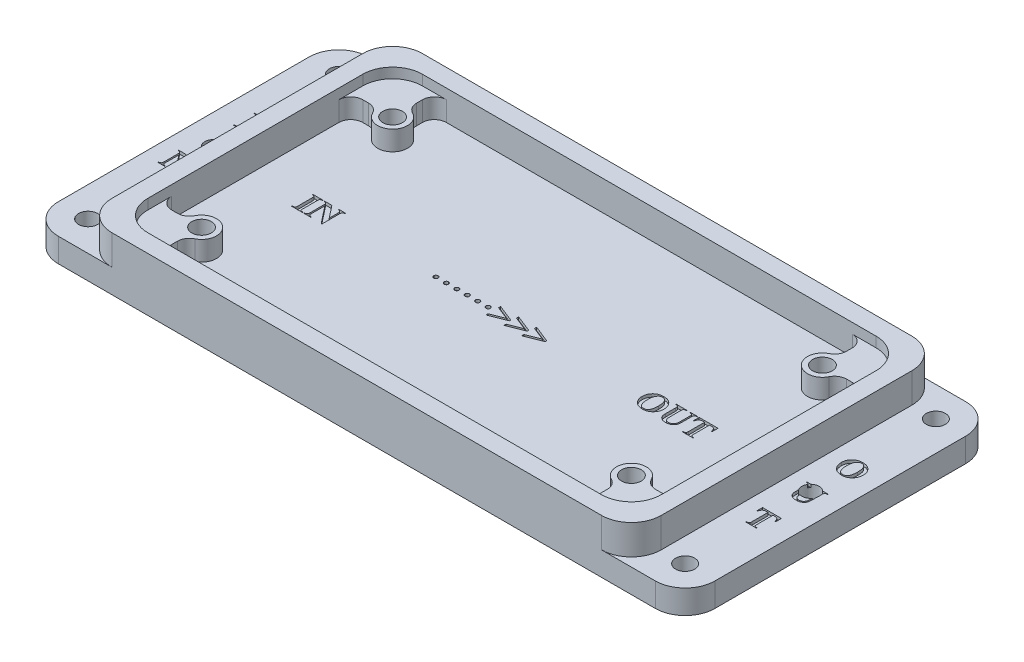
from build123d import *

# Parameters (mm, degrees)
SKETCH_1_W          = 92
SKETCH_1_H          = 52
SKETCH_1_W_2        = 86
SKETCH_1_H_2        = 46
EXTRUDE_1_DEPTH     = 5
SKETCH_2_R          = 1.65
EXTRUDE_3_DEPTH     = 5
FILLET_1_R          = 2
FILLET_2_R          = 5
SKETCH_3_W          = 86
SKETCH_3_H          = 46
CUT_EXTRUDE_1_DEPTH = 1.7
SKETCH_5_W          = 110
SKETCH_5_H          = 52
SKETCH_5_R          = 1.6
SKETCH_5_R_2        = 1.45
EXTRUDE_4_DEPTH     = 4
SKETCH_6_R          = 3
CUT_EXTRUDE_2_DEPTH = 3
FILLET_3_R          = 5
CUT_EXTRUDE_3_DEPTH = 0.5
SKETCH_8_R          = 1.65
CUT_EXTRUDE_4_DEPTH = 62.040969981


with BuildPart() as part:
    # 草图1 → 凸台-拉伸1 (new body)
    with BuildSketch(Plane(origin=(0, 0, 0), x_dir=(1, 0, 0), z_dir=(0, 1, 0))):
        Rectangle(SKETCH_1_W, SKETCH_1_H)
        Rectangle(SKETCH_1_W_2, SKETCH_1_H_2, mode=Mode.SUBTRACT)
    extrude(amount=EXTRUDE_1_DEPTH)

    # 草图2 → 凸台-拉伸3 (add)
    # profile 1 of 4: a face of its own
    with BuildSketch(Plane.XZ):
        with BuildLine():
            Line((43, 23), (36, 23))
            Line((36, 23), (36, 18.5))
            ThreePointArc((36, 18.5), (34.232233047, 14.232233047), (38.5, 16))
            Line((38.5, 16), (43, 16))
            Line((43, 16), (43, 23))
        make_face()
        with Locations(Location((36, 16, 0), (0, 0, 270))):
            Circle(SKETCH_2_R, mode=Mode.SUBTRACT)
    # profile 2 of 4: a face of its own
    with BuildSketch(Plane.XZ):
        with BuildLine():
            Line((36, -18.5), (36, -23))
            Line((36, -23), (43, -23))
            Line((43, -23), (43, -16))
            Line((43, -16), (38.5, -16))
            ThreePointArc((38.5, -16), (34.232233047, -14.232233047), (36, -18.5))
        make_face()
        with Locations(Location((36, -16, 0), (0, 0, 270))):
            Circle(SKETCH_2_R, mode=Mode.SUBTRACT)
    # profile 3 of 4: a face of its own
    with BuildSketch(Plane.XZ):
        with BuildLine():
            Line((-38.5, -16), (-43, -16))
            Line((-43, -16), (-43, -23))
            Line((-43, -23), (-36, -23))
            Line((-36, -23), (-36, -18.5))
            ThreePointArc((-36, -18.5), (-34.232233047, -14.232233047), (-38.5, -16))
        make_face()
        with Locations(Location((-36, -16, 0), (0, 0, 270))):
            Circle(SKETCH_2_R, mode=Mode.SUBTRACT)
    # profile 4 of 4: a face of its own
    with BuildSketch(Plane.XZ):
        with BuildLine():
            Line((-43, 16), (-38.5, 16))
            ThreePointArc((-38.5, 16), (-34.232233047, 14.232233047), (-36, 18.5))
            Line((-36, 18.5), (-36, 23))
            Line((-36, 23), (-43, 23))
            Line((-43, 23), (-43, 16))
        make_face()
        with BuildLine():
            ThreePointArc((-36, 17.65), (-34.833273811, 17.166726189), (-34.35, 16))
            ThreePointArc((-34.35, 16), (-37.166726189, 14.833273811), (-36, 17.65))
        make_face(mode=Mode.SUBTRACT)
    extrude(amount=-EXTRUDE_3_DEPTH)

    # 圆角1
    fillet_1_edges = [part.edges().sort_by_distance(p)[0] for p in [
        (-38.5, 2.5, 16),
        (-43, 2.5, 16),
        (-36, 2.5, 23),
        (-36, 2.5, 18.5),
        (-36, 2.5, -18.5),
        (-36, 2.5, -23),
        (-43, 2.5, -16),
        (-38.5, 2.5, -16),
        (38.5, 2.5, -16),
        (43, 2.5, -16),
        (36, 2.5, -23),
        (36, 2.5, -18.5),
        (36, 2.5, 18.5),
        (36, 2.5, 23),
        (43, 2.5, 16),
        (38.5, 2.5, 16),
    ]]
    fillet(fillet_1_edges, radius=FILLET_1_R)

    # 圆角2
    fillet_2_edges = [part.edges().sort_by_distance(p)[0] for p in [
        (46, 2.5, -26),
        (46, 2.5, 26),
        (-46, 2.5, 26),
        (-46, 2.5, -26),
    ]]
    fillet(fillet_2_edges, radius=FILLET_2_R)

    # 草图3 → 切除-拉伸1 (cut)
    with BuildSketch(Plane(origin=(0, 5, 0), x_dir=(1, 0, 0), z_dir=(0, 1, 0))):
        Rectangle(SKETCH_3_W, SKETCH_3_H)
    extrude(amount=-CUT_EXTRUDE_1_DEPTH, mode=Mode.SUBTRACT)

    # 草图5 → 凸台-拉伸4 (add)
    with BuildSketch(Plane.XZ):
        Rectangle(SKETCH_5_W, SKETCH_5_H)
        with Locations(Location((-50, 21, 0), (0, 0, 270))):
            Circle(SKETCH_5_R, mode=Mode.SUBTRACT)
        with Locations(Location((-50, -21, 0), (0, 0, 270))):
            Circle(SKETCH_5_R, mode=Mode.SUBTRACT)
        with Locations(Location((50, -21, 0), (0, 0, 270))):
            Circle(SKETCH_5_R, mode=Mode.SUBTRACT)
        with Locations(Location((50, 21, 0), (0, 0, 270))):
            Circle(SKETCH_5_R, mode=Mode.SUBTRACT)
        with Locations(Location((-50, 0, 0), (0, 0, 270))):
            Circle(SKETCH_5_R_2, mode=Mode.SUBTRACT)
        with Locations(Location((50, 0, 0), (0, 0, 270))):
            Circle(SKETCH_5_R_2, mode=Mode.SUBTRACT)
    extrude(amount=EXTRUDE_4_DEPTH)

    # 草图6 → 切除-拉伸2 (cut)
    with BuildSketch(Plane.XZ.offset(4)):
        with Locations(Location((-36, 16, 0), (0, 0, 270))):
            Circle(SKETCH_6_R)
        with Locations(Location((-36, -16, 0), (0, 0, 270))):
            Circle(SKETCH_6_R)
        with Locations(Location((36, -16, 0), (0, 0, 270))):
            Circle(SKETCH_6_R)
        with Locations(Location((36, 16, 0), (0, 0, 270))):
            Circle(SKETCH_6_R)
    extrude(amount=-CUT_EXTRUDE_2_DEPTH, mode=Mode.SUBTRACT)

    # 圆角3
    fillet_3_edges = [part.edges().sort_by_distance(p)[0] for p in [
        (43, 4.15, -23),
        (43, 4.15, 23),
        (-43, 4.15, 23),
        (-43, 4.15, -23),
        (55, -2, -26),
        (55, -2, 26),
        (-55, -2, 26),
        (-55, -2, -26),
    ]]
    fillet(fillet_3_edges, radius=FILLET_3_R)

    # 草图7 → 切除-拉伸3 (cut)
    # profile 1 of 19: a face of its own
    with BuildSketch(Plane(origin=(0, 0, 0), x_dir=(1, 0, 0), z_dir=(0, 1, 0))):
        with BuildLine():
            Line((-49.64597424, 4.876015985), (-49.64597424, 4.778793763))
            Line((-49.64597424, 4.778793763), (-51.444585351, 4.778793763))
            Line((-51.444585351, 4.778793763), (-51.444585351, 4.876015985))
            Line((-51.444585351, 4.876015985), (-51.329893511, 4.876015985))
            add(Edge.make_bspline(
                [(-51.329893511, 4.876015985), (-51.306049854, 4.876461375), (-51.260664938, 4.877309148), (-51.196166444, 4.887384821), (-51.138593177, 4.903341619), (-51.104605299, 4.920311985), (-51.088357053, 4.928424839)],
                knots=[0, 0, 0, 0, 1.144467932, 2.17842344, 3.129177061, 4, 4, 4, 4], degree=3))
            add(Edge.make_bspline(
                [(-51.088357053, 4.928424839), (-51.077682569, 4.93486423), (-51.056090546, 4.947889636), (-51.028359682, 4.975480981), (-51.004859905, 5.009114491), (-50.992795535, 5.034559546), (-50.986577539, 5.047673971)],
                knots=[0, 0, 0, 0, 0.93343552, 1.888125192, 2.911536119, 4, 4, 4, 4], degree=3))
            add(Edge.make_bspline(
                [(-50.986577539, 5.047673971), (-50.98409666, 5.053690214), (-50.978445319, 5.067394974), (-50.974243547, 5.091971632), (-50.968150891, 5.121887434), (-50.965076377, 5.158290125), (-50.961974832, 5.200809371), (-50.959557239, 5.249182981), (-50.9593037, 5.303643651), (-50.958761497, 5.34187322), (-50.95847424, 5.362127096)],
                knots=[0, 0, 0, 0, 0.491154816, 1.118830903, 1.878082211, 2.802823963, 3.878617243, 5.106317376, 6.466938293, 8, 8, 8, 8], degree=3))
            Line((-50.95847424, 5.362127096), (-50.95847424, 7.695460429))
            add(Edge.make_bspline(
                [(-50.95847424, 7.695460429), (-50.958764886, 7.715967353), (-50.959321065, 7.755209279), (-50.959526399, 7.810937508), (-50.961994424, 7.8605718), (-50.965031198, 7.903863756), (-50.968345973, 7.941480344), (-50.9740557, 7.972746866), (-50.978590472, 7.998473468), (-50.988148546, 8.024234974), (-51.003371126, 8.052386992), (-51.02916782, 8.082059648), (-51.061554477, 8.109471196), (-51.100594599, 8.134747562), (-51.147157879, 8.156227835), (-51.201559066, 8.170892315), (-51.263244047, 8.180142628), (-51.306816228, 8.181076781), (-51.329893511, 8.18157154)],
                knots=[0, 0, 0, 0, 1.353963977, 2.590937397, 3.678525439, 4.633585292, 5.456840327, 6.168525469, 6.732370981, 7.176481794, 7.976852204, 8.830756602, 9.755347706, 10.770665926, 11.892520065, 13.125421506, 14.477527201, 16, 16, 16, 16], degree=3))
            Line((-51.329893511, 8.18157154), (-51.444585351, 8.18157154))
            Line((-51.444585351, 8.18157154), (-51.444585351, 8.278793763))
            Line((-51.444585351, 8.278793763), (-49.64597424, 8.278793763))
            Line((-49.64597424, 8.278793763), (-49.64597424, 8.18157154))
            Line((-49.64597424, 8.18157154), (-49.759906532, 8.18157154))
            add(Edge.make_bspline(
                [(-49.759906532, 8.18157154), (-49.783747478, 8.181116838), (-49.829127235, 8.18025134), (-49.893420048, 8.170332712), (-49.950650556, 8.1540854), (-49.984430507, 8.137258706), (-50.000683442, 8.129162686)],
                knots=[0, 0, 0, 0, 1.147815573, 2.184795468, 3.126629849, 4, 4, 4, 4], degree=3))
            add(Edge.make_bspline(
                [(-50.000683442, 8.129162686), (-50.011368317, 8.122731311), (-50.032981359, 8.10972212), (-50.060652739, 8.081898682), (-50.084967088, 8.048557785), (-50.097520551, 8.023045304), (-50.103982053, 8.009913554)],
                knots=[0, 0, 0, 0, 0.928829741, 1.878808762, 2.908183361, 4, 4, 4, 4], degree=3))
            add(Edge.make_bspline(
                [(-50.103982053, 8.009913554), (-50.106451535, 8.003895077), (-50.111982867, 7.99041444), (-50.11652263, 7.96591079), (-50.122292286, 7.935931054), (-50.125517377, 7.899303534), (-50.128546567, 7.857027922), (-50.131038796, 7.808659663), (-50.131241399, 7.754196509), (-50.131794335, 7.715714135), (-50.132085351, 7.695460429)],
                knots=[0, 0, 0, 0, 0.491143652, 1.100100526, 1.878201893, 2.802922625, 3.87869145, 5.087223688, 6.466973141, 8, 8, 8, 8], degree=3))
            Line((-50.132085351, 7.695460429), (-50.132085351, 5.362127096))
            add(Edge.make_bspline(
                [(-50.132085351, 5.362127096), (-50.131804223, 5.341619544), (-50.131266257, 5.302376416), (-50.130938335, 5.246656279), (-50.128857611, 5.196976447), (-50.124602899, 5.153492573), (-50.121218512, 5.115945391), (-50.116841537, 5.084163547), (-50.111077712, 5.05870672), (-50.101944686, 5.032566045), (-50.085201224, 5.005346201), (-50.05999445, 4.975462263), (-50.027448734, 4.948136419), (-49.988457453, 4.922833736), (-49.941879057, 4.90136161), (-49.887482468, 4.886694642), (-49.826047126, 4.877482583), (-49.782729792, 4.876522067), (-49.759906532, 4.876015985)],
                knots=[0, 0, 0, 0, 1.354319329, 2.591617395, 3.679490877, 4.636117144, 5.476222309, 6.168990776, 6.752950479, 7.19717785, 7.991448918, 8.845577426, 9.770411191, 10.785995884, 11.908144457, 13.141369476, 14.493830035, 16, 16, 16, 16], degree=3))
            Line((-49.759906532, 4.876015985), (-49.64597424, 4.876015985))
        make_face()
    # profile 2 of 19: a face of its own
    with BuildSketch(Plane(origin=(0, 0, 0), x_dir=(1, 0, 0), z_dir=(0, 1, 0))):
        with BuildLine():
            Line((-51.181579149, -3.436958688), (-49.550068732, -5.50824775))
            Line((-49.550068732, -5.50824775), (-49.550068732, -4.117514243))
            add(Edge.make_bspline(
                [(-49.550068732, -4.117514243), (-49.550419381, -4.091687673), (-49.551090138, -4.042283872), (-49.554500658, -3.971523669), (-49.561667787, -3.907465532), (-49.569974137, -3.849372556), (-49.583207627, -3.79830251), (-49.597356088, -3.753336739), (-49.614461953, -3.714704959), (-49.629502735, -3.692740741), (-49.636657274, -3.682292889)],
                knots=[0, 0, 0, 0, 1.37708922, 2.634242248, 3.774587307, 4.813165717, 5.759297908, 6.583135444, 7.326031535, 8, 8, 8, 8], degree=3))
            add(Edge.make_bspline(
                [(-49.636657274, -3.682292889), (-49.647232024, -3.670089905), (-49.668412749, -3.645647905), (-49.706154025, -3.614182286), (-49.749027006, -3.588360494), (-49.796892737, -3.567768523), (-49.84966549, -3.551952225), (-49.907383097, -3.540587559), (-49.970225377, -3.534677671), (-50.013635077, -3.534350714), (-50.036179843, -3.53418091)],
                knots=[0, 0, 0, 0, 0.876036587, 1.754659902, 2.655600339, 3.585565811, 4.577428142, 5.642743129, 6.775761992, 8, 8, 8, 8], degree=3))
            Line((-50.036179843, -3.53418091), (-50.036179843, -3.436958688))
            Line((-50.036179843, -3.436958688), (-48.820902065, -3.436958688))
            Line((-48.820902065, -3.436958688), (-48.820902065, -3.53418091))
            add(Edge.make_bspline(
                [(-48.820902065, -3.53418091), (-48.856939229, -3.538716568), (-48.922744868, -3.546998903), (-49.011173867, -3.565465385), (-49.080980481, -3.58414477), (-49.134543959, -3.606387057), (-49.175480555, -3.635122229), (-49.20898822, -3.670140286), (-49.238954726, -3.711624134), (-49.265099771, -3.762151745), (-49.28494561, -3.826216595), (-49.29740975, -3.906955877), (-49.305512014, -4.005949165), (-49.306484864, -4.078250489), (-49.307013176, -4.117514243)],
                knots=[0, 0, 0, 0, 1.47293099, 2.689644668, 3.661742309, 4.402208035, 5.02909861, 5.67554278, 6.359727415, 7.099337769, 7.973129416, 9.067356349, 10.407406766, 12, 12, 12, 12], degree=3))
            Line((-49.307013176, -4.117514243), (-49.307013176, -6.985569799))
            Line((-49.307013176, -6.985569799), (-49.418666822, -6.985569799))
            Line((-49.418666822, -6.985569799), (-51.688957621, -4.101563722))
            Line((-51.688957621, -4.101563722), (-51.688957621, -6.353625354))
            add(Edge.make_bspline(
                [(-51.688957621, -6.353625354), (-51.688399708, -6.376417543), (-51.687325736, -6.420292106), (-51.682554359, -6.483340998), (-51.672632631, -6.540494645), (-51.659047706, -6.591915069), (-51.64175217, -6.637619617), (-51.620674328, -6.677939589), (-51.594366795, -6.711512468), (-51.555757652, -6.749149269), (-51.500792646, -6.784760917), (-51.430438299, -6.816817436), (-51.355310578, -6.836516527), (-51.303475244, -6.838655579), (-51.277282274, -6.839736465)],
                knots=[0, 0, 0, 0, 1.127047964, 2.169547561, 3.122229636, 3.990523395, 4.794755099, 5.533929617, 6.229880341, 6.893690072, 8.19195966, 9.44115978, 10.706989644, 12, 12, 12, 12], degree=3))
            Line((-51.277282274, -6.839736465), (-51.20284651, -6.839736465))
            Line((-51.20284651, -6.839736465), (-51.20284651, -6.936958688))
            Line((-51.20284651, -6.936958688), (-52.418124288, -6.936958688))
            Line((-52.418124288, -6.936958688), (-52.418124288, -6.839736465))
            add(Edge.make_bspline(
                [(-52.418124288, -6.839736465), (-52.396339331, -6.839211314), (-52.354476418, -6.838202161), (-52.294064903, -6.832983138), (-52.238598089, -6.824236762), (-52.188522091, -6.810957927), (-52.143142516, -6.796287835), (-52.103175806, -6.777299988), (-52.068738602, -6.754130235), (-52.038457206, -6.728205613), (-52.012817272, -6.697554248), (-51.990816149, -6.662570094), (-51.972621203, -6.622349619), (-51.957570992, -6.577836776), (-51.946264328, -6.528434122), (-51.938172682, -6.474605229), (-51.932562449, -6.415771815), (-51.932201271, -6.374907033), (-51.932013176, -6.353625354)],
                knots=[0, 0, 0, 0, 1.302254148, 2.502467739, 3.622024049, 4.653421555, 5.596190003, 6.46934253, 7.287800068, 8.07079221, 8.843923894, 9.666846287, 10.533548967, 11.476317415, 12.471093534, 13.558375583, 14.728443775, 16, 16, 16, 16], degree=3))
            Line((-51.932013176, -6.353625354), (-51.932013176, -3.793946535))
            Line((-51.932013176, -3.793946535), (-51.97378835, -3.741537681))
            add(Edge.make_bspline(
                [(-51.97378835, -3.741537681), (-51.991194314, -3.722245185), (-52.023973278, -3.685913499), (-52.074568334, -3.639587545), (-52.1221419, -3.603952989), (-52.168163344, -3.576794262), (-52.218070352, -3.559320576), (-52.274388376, -3.545146585), (-52.340233541, -3.537808897), (-52.3872257, -3.535434902), (-52.412047899, -3.53418091)],
                knots=[0, 0, 0, 0, 1.235439228, 2.326582838, 3.256262787, 4.059856782, 4.856199611, 5.761619077, 6.817642388, 8, 8, 8, 8], degree=3))
            Line((-52.412047899, -3.53418091), (-52.412047899, -3.436958688))
            Line((-52.412047899, -3.436958688), (-51.181579149, -3.436958688))
        make_face()
    # profile 3 of 19: a face of its own
    with BuildSketch(Plane(origin=(0, 0, 0), x_dir=(1, 0, 0), z_dir=(0, 1, 0))):
        with BuildLine():
            add(Edge.make_bspline(
                [(50.217896868, 8.53294439), (50.285534403, 8.533998996), (50.417802401, 8.53606132), (50.611835373, 8.517014725), (50.796286388, 8.48246127), (50.971258652, 8.431120552), (51.135772734, 8.361144222), (51.291086409, 8.274948795), (51.436578512, 8.171280147), (51.570482443, 8.051273249), (51.691106708, 7.919076052), (51.797603356, 7.777926684), (51.887682571, 7.628598444), (51.96095184, 7.470893059), (52.018404435, 7.305295943), (52.05809037, 7.13131034), (52.083208344, 6.949510674), (52.086320521, 6.825562974), (52.087905549, 6.762436578)],
                knots=[0, 0, 0, 0, 1.117599178, 2.185511443, 3.216596641, 4.216496892, 5.193720437, 6.166199278, 7.147635958, 8.140749636, 9.133263309, 10.101842832, 11.059452728, 12.010747998, 12.971773146, 13.951566087, 14.956735376, 16, 16, 16, 16], degree=3))
            add(Edge.make_bspline(
                [(52.087905549, 6.762436578), (52.086769367, 6.70820425), (52.08452758, 6.601199002), (52.06577476, 6.443181211), (52.035220701, 6.290139462), (51.993869572, 6.141440432), (51.938840552, 5.998169809), (51.871257274, 5.860410322), (51.79369081, 5.726307119), (51.731758547, 5.643056877), (51.700535757, 5.601086752)],
                knots=[0, 0, 0, 0, 1.043246653, 2.058419255, 3.056808262, 4.043829632, 5.024555343, 6.005002729, 6.994233708, 8, 8, 8, 8], degree=3))
            add(Edge.make_bspline(
                [(51.700535757, 5.601086752), (51.678837748, 5.573967576), (51.635862933, 5.520255664), (51.566087584, 5.445192116), (51.494448656, 5.373993532), (51.417814274, 5.309689342), (51.339018097, 5.249438406), (51.256667778, 5.194455897), (51.170783524, 5.145225347), (51.081782515, 5.101004537), (50.989312697, 5.062336357), (50.893955857, 5.027818603), (50.794515255, 5.000087633), (50.692189339, 4.976383409), (50.58643418, 4.958151929), (50.477631819, 4.945667015), (50.365656552, 4.936545422), (50.289820092, 4.935999393), (50.251317007, 4.935722168)],
                knots=[0, 0, 0, 0, 1.00627325, 1.9930127, 2.968556301, 3.931628562, 4.889992766, 5.842467438, 6.799060146, 7.757311971, 8.720859362, 9.702647782, 10.694476427, 11.710892394, 12.745970349, 13.802697082, 14.884402792, 16, 16, 16, 16], degree=3))
            add(Edge.make_bspline(
                [(50.251317007, 4.935722168), (50.212818586, 4.936074742), (50.136756707, 4.936771328), (50.024259202, 4.944868587), (49.914953532, 4.956609972), (49.808927881, 4.974031893), (49.706517676, 4.997373192), (49.606661111, 5.023076723), (49.51105479, 5.056211923), (49.41863304, 5.093720964), (49.329009651, 5.135075458), (49.242975368, 5.182273039), (49.160854024, 5.235030388), (49.081765575, 5.29209998), (49.005483476, 5.35346889), (48.933248746, 5.42078951), (48.86402446, 5.49283341), (48.820810142, 5.544128212), (48.799060062, 5.569945258)],
                knots=[0, 0, 0, 0, 1.12499151, 2.222661784, 3.294793131, 4.33735381, 5.360698186, 6.364076506, 7.349253377, 8.315262806, 9.278632822, 10.232406028, 11.180767221, 12.129590213, 13.081869556, 14.040110377, 15.013573345, 16, 16, 16, 16], degree=3))
            add(Edge.make_bspline(
                [(48.799060062, 5.569945258), (48.766652664, 5.61219527), (48.702197779, 5.69622607), (48.61953496, 5.831033013), (48.550054907, 5.97179367), (48.492945071, 6.118190934), (48.447962239, 6.270349394), (48.416185799, 6.428427403), (48.396650267, 6.592309533), (48.394534897, 6.703643273), (48.393461104, 6.760157932)],
                knots=[0, 0, 0, 0, 0.995754374, 1.980450006, 2.952842694, 3.929288476, 4.917067138, 5.917621276, 6.942953664, 8, 8, 8, 8], degree=3))
            add(Edge.make_bspline(
                [(48.393461104, 6.760157932), (48.395088109, 6.823274968), (48.398282709, 6.947204288), (48.422820424, 7.129252742), (48.464748838, 7.302943907), (48.522804777, 7.468835718), (48.596570305, 7.626937875), (48.687583855, 7.776617889), (48.795616831, 7.917837911), (48.91868612, 8.049640823), (49.053239234, 8.169454928), (49.196837859, 8.274058174), (49.348792677, 8.359882015), (49.50796951, 8.429774835), (49.674779263, 8.482314937), (49.849467294, 8.516946304), (50.031383745, 8.536008407), (50.155067132, 8.53397655), (50.217896868, 8.53294439)],
                knots=[0, 0, 0, 0, 1.060255294, 2.081794832, 3.079505486, 4.0575798, 5.030022739, 6.005429218, 6.99491703, 8.012249652, 9.030720031, 10.017772549, 10.991257006, 11.957043232, 12.933793802, 13.923226749, 14.945023109, 16, 16, 16, 16], degree=3))
        make_face()
        with BuildLine():
            add(Edge.make_bspline(
                [(50.248278812, 8.338499946), (50.209413248, 8.337151406), (50.133510609, 8.33451777), (50.023613939, 8.310638718), (49.920589836, 8.273771546), (49.825179051, 8.220002107), (49.736378187, 8.15227328), (49.656294111, 8.067763315), (49.582855074, 7.969289246), (49.541819962, 7.895702579), (49.520631243, 7.857705675)],
                knots=[0, 0, 0, 0, 1.010341478, 1.973149883, 2.913323355, 3.848402755, 4.811842333, 5.809142135, 6.868737798, 8, 8, 8, 8], degree=3))
            add(Edge.make_bspline(
                [(49.520631243, 7.857705675), (49.503997116, 7.823308033), (49.469568827, 7.752113917), (49.429851983, 7.636104839), (49.394617606, 7.510119806), (49.365970485, 7.373361913), (49.344349782, 7.225696721), (49.328667976, 7.067539235), (49.318471084, 6.898782791), (49.317547673, 6.782706716), (49.317072215, 6.72294005)],
                knots=[0, 0, 0, 0, 0.787943638, 1.630837067, 2.525905988, 3.487208031, 4.51219802, 5.604605297, 6.766629954, 8, 8, 8, 8], degree=3))
            add(Edge.make_bspline(
                [(49.317072215, 6.72294005), (49.317732785, 6.652015583), (49.319010763, 6.514800782), (49.334847806, 6.316309357), (49.358379528, 6.132040134), (49.392294228, 5.962132673), (49.436165378, 5.806293796), (49.489754126, 5.66473573), (49.553094136, 5.536786244), (49.605311017, 5.461037872), (49.630765792, 5.424111925)],
                knots=[0, 0, 0, 0, 1.253361503, 2.424829634, 3.517270749, 4.535371114, 5.484506921, 6.375489106, 7.20808062, 8, 8, 8, 8], degree=3))
            add(Edge.make_bspline(
                [(49.630765792, 5.424111925), (49.649455011, 5.400576044), (49.685983846, 5.354574213), (49.749600018, 5.294740211), (49.817885864, 5.243051819), (49.893148162, 5.202569198), (49.972475489, 5.169028444), (50.057894402, 5.146602421), (50.148564634, 5.132610692), (50.211007357, 5.130993962), (50.242961972, 5.130166613)],
                knots=[0, 0, 0, 0, 1.020058884, 1.99374635, 2.959073536, 3.921751619, 4.889988268, 5.879249688, 6.914721236, 8, 8, 8, 8], degree=3))
            add(Edge.make_bspline(
                [(50.242961972, 5.130166613), (50.285396442, 5.131338385), (50.367478201, 5.133604967), (50.484699003, 5.159178468), (50.592504142, 5.197253106), (50.655009146, 5.237298081), (50.685778812, 5.257011231)],
                knots=[0, 0, 0, 0, 1.086516288, 2.101667992, 3.065498145, 4, 4, 4, 4], degree=3))
            add(Edge.make_bspline(
                [(50.685778812, 5.257011231), (50.7042525, 5.271142314), (50.741795969, 5.299860452), (50.794403225, 5.349305938), (50.842596379, 5.405965618), (50.888562481, 5.467712476), (50.930965339, 5.535645714), (50.970695302, 5.609307926), (51.005890069, 5.689686305), (51.039869274, 5.775503868), (51.068987734, 5.868253884), (51.095338935, 5.96746959), (51.115662377, 6.073720941), (51.134536577, 6.186294128), (51.147614509, 6.305755885), (51.157777065, 6.431878211), (51.16262179, 6.564916982), (51.163727769, 6.655844076), (51.164294437, 6.702432238)],
                knots=[0, 0, 0, 0, 0.707878774, 1.438598863, 2.192768746, 2.969795667, 3.780358143, 4.628744544, 5.515519471, 6.450279976, 7.437595481, 8.473401936, 9.573958948, 10.729714514, 11.947871327, 13.231394215, 14.581454142, 16, 16, 16, 16], degree=3))
            add(Edge.make_bspline(
                [(51.164294437, 6.702432238), (51.163829141, 6.757378843), (51.16292827, 6.863762097), (51.156820193, 7.018013924), (51.147103472, 7.161647767), (51.13373747, 7.294720192), (51.115994877, 7.417007568), (51.092622028, 7.528316703), (51.067891649, 7.629447857), (51.036903575, 7.720012887), (51.00280396, 7.801662298), (50.968434123, 7.877524302), (50.930003575, 7.946278734), (50.891161366, 8.010046353), (50.848079521, 8.066010135), (50.804157109, 8.117012004), (50.756935095, 8.160847446), (50.692185935, 8.2114727), (50.605562291, 8.263216261), (50.492945414, 8.30640186), (50.373198774, 8.33441617), (50.290467059, 8.337120764), (50.248278812, 8.338499946)],
                knots=[0, 0, 0, 0, 1.564715362, 3.029477591, 4.395383686, 5.663787164, 6.837420581, 7.912070591, 8.901835802, 9.800165859, 10.634314221, 11.421391877, 12.170015688, 12.876189058, 13.5452815, 14.178775877, 14.79090283, 15.376466922, 16.517763855, 17.647800425, 18.800518316, 20, 20, 20, 20], degree=3))
        make_face(mode=Mode.SUBTRACT)
    # profile 4 of 19: a face of its own
    with BuildSketch(Plane(origin=(0, 0, 0), x_dir=(1, 0, 0), z_dir=(0, 1, 0))):
        with BuildLine():
            Line((48.296238882, 1.053777724), (50.094849993, 1.053777724))
            Line((50.094849993, 1.053777724), (50.094849993, 0.956555502))
            Line((50.094849993, 0.956555502), (50.009021, 0.956555502))
            add(Edge.make_bspline(
                [(50.009021, 0.956555502), (49.979122326, 0.956302635), (49.924523646, 0.955840869), (49.850072841, 0.948267143), (49.790449859, 0.937110345), (49.74390545, 0.92044321), (49.708884157, 0.897733502), (49.680541798, 0.872302625), (49.656270467, 0.843882217), (49.640447552, 0.816126574), (49.631265654, 0.789047086), (49.625500886, 0.762284758), (49.620485001, 0.729290429), (49.615631578, 0.689809051), (49.613136242, 0.644145606), (49.610742949, 0.59199245), (49.609295638, 0.533493918), (49.608931159, 0.492218717), (49.608738882, 0.47044439)],
                knots=[0, 0, 0, 0, 1.873611657, 3.421446737, 4.685315238, 5.669949158, 6.497780211, 7.284732133, 8.050919915, 8.832571355, 9.269293487, 9.839173886, 10.546366176, 11.361468866, 12.331797416, 13.412206959, 14.634835235, 16, 16, 16, 16], degree=3))
            Line((49.608738882, 0.47044439), (49.608738882, -1.264364637))
            add(Edge.make_bspline(
                [(49.608738882, -1.264364637), (49.608715959, -1.302347229), (49.608672087, -1.375042912), (49.612945636, -1.47885297), (49.617864156, -1.572590666), (49.625221142, -1.656239581), (49.635288012, -1.729904644), (49.64587894, -1.79408344), (49.660249156, -1.847864593), (49.6812783, -1.906286303), (49.71680832, -1.968866607), (49.767746909, -2.037441121), (49.831085942, -2.098591051), (49.905000615, -2.152447561), (49.989398615, -2.198385834), (50.085965694, -2.228251027), (50.19167407, -2.249231405), (50.265885639, -2.250906541), (50.30448541, -2.251777832)],
                knots=[0, 0, 0, 0, 1.300992195, 2.489996405, 3.558512469, 4.516486413, 5.365297801, 6.105361831, 6.742819091, 7.269669067, 8.228349452, 9.194533075, 10.188122344, 11.230698299, 12.320957625, 13.461922122, 14.679865887, 16, 16, 16, 16], degree=3))
            add(Edge.make_bspline(
                [(50.30448541, -2.251777832), (50.348908528, -2.250218685), (50.435166799, -2.247191223), (50.559332245, -2.222497931), (50.673337645, -2.182046649), (50.777009724, -2.125692603), (50.867871708, -2.05316564), (50.949393337, -1.970397926), (51.014904606, -1.872708703), (51.061904319, -1.783007806), (51.091670195, -1.700979571), (51.111310809, -1.628059196), (51.12755625, -1.544766477), (51.141126386, -1.4509713), (51.151550462, -1.346807912), (51.158957705, -1.232046523), (51.163513282, -1.106668678), (51.164027133, -1.019540897), (51.164294437, -0.974217068)],
                knots=[0, 0, 0, 0, 1.208075288, 2.345771551, 3.428856258, 4.489532947, 5.539753161, 6.58248904, 7.637421869, 8.72819277, 9.329769644, 10.008360403, 10.78123502, 11.637693061, 12.586496199, 13.629118266, 14.766668491, 16, 16, 16, 16], degree=3))
            Line((51.164294437, -0.974217068), (51.164294437, 0.47044439))
            add(Edge.make_bspline(
                [(51.164294437, 0.47044439), (51.163875542, 0.503650824), (51.163102981, 0.564892882), (51.153643206, 0.649130693), (51.141110038, 0.718949717), (51.11876013, 0.774017242), (51.093148362, 0.817695709), (51.064722899, 0.853502399), (51.032679914, 0.882330754), (51.008359496, 0.895949646), (50.996434194, 0.90262755)],
                knots=[0, 0, 0, 0, 1.628272018, 3.002994269, 4.157936954, 5.094593422, 5.902138284, 6.635561567, 7.330959666, 8, 8, 8, 8], degree=3))
            add(Edge.make_bspline(
                [(50.996434194, 0.90262755), (50.975873715, 0.911108802), (50.931985354, 0.929212868), (50.857230177, 0.944374058), (50.771705069, 0.955638379), (50.71064061, 0.956237209), (50.678183326, 0.956555502)],
                knots=[0, 0, 0, 0, 0.819172695, 1.748604514, 2.8033271, 4, 4, 4, 4], degree=3))
            Line((50.678183326, 0.956555502), (50.678183326, 1.053777724))
            Line((50.678183326, 1.053777724), (51.893461104, 1.053777724))
            Line((51.893461104, 1.053777724), (51.893461104, 0.956555502))
            Line((51.893461104, 0.956555502), (51.822063535, 0.956555502))
            add(Edge.make_bspline(
                [(51.822063535, 0.956555502), (51.798974387, 0.956153724), (51.754299038, 0.955376322), (51.690614117, 0.944349092), (51.632526254, 0.92780063), (51.580553768, 0.904424862), (51.534840229, 0.87378141), (51.496699869, 0.835703682), (51.463478399, 0.791945414), (51.448473065, 0.758178048), (51.440770132, 0.740843696)],
                knots=[0, 0, 0, 0, 1.183120061, 2.289227139, 3.304431175, 4.275119626, 5.200974401, 6.11028159, 7.02992005, 8, 8, 8, 8], degree=3))
            add(Edge.make_bspline(
                [(51.440770132, 0.740843696), (51.435546675, 0.72601617), (51.423562059, 0.691996133), (51.414284471, 0.63125904), (51.408539288, 0.555892965), (51.407769589, 0.50059158), (51.407349993, 0.47044439)],
                knots=[0, 0, 0, 0, 0.687610812, 1.577643118, 2.679467964, 4, 4, 4, 4], degree=3))
            Line((51.407349993, 0.47044439), (51.407349993, -0.864082519))
            add(Edge.make_bspline(
                [(51.407349993, -0.864082519), (51.407021361, -0.913962049), (51.406387353, -1.010191274), (51.402610058, -1.148963024), (51.396612177, -1.276853661), (51.3884998, -1.394155462), (51.377530763, -1.500887441), (51.362771995, -1.596535953), (51.347375089, -1.681662927), (51.328163512, -1.757630979), (51.304627056, -1.828006995), (51.272534306, -1.894425783), (51.234823897, -1.960145844), (51.188477607, -2.023810335), (51.136480011, -2.08723466), (51.075588335, -2.147734044), (51.008781757, -2.208022272), (50.934885044, -2.266275845), (50.853792612, -2.320394511), (50.765174496, -2.367799402), (50.669145934, -2.40714134), (50.56608305, -2.43884141), (50.456145432, -2.463885561), (50.339166276, -2.482021542), (50.214800673, -2.492597318), (50.129556598, -2.494074181), (50.08573541, -2.494833387)],
                knots=[0, 0, 0, 0, 1.467844093, 2.831812955, 4.08493233, 5.235248227, 6.291710913, 7.241099964, 8.082787107, 8.836329886, 9.545547297, 10.262123183, 11.003298874, 11.772408823, 12.576590708, 13.414278216, 14.295372854, 15.223952147, 16.180709153, 17.16068275, 18.17626284, 19.229647179, 20.330345869, 21.491588469, 22.710507751, 24, 24, 24, 24], degree=3))
            add(Edge.make_bspline(
                [(50.08573541, -2.494833387), (50.049274946, -2.494262633), (49.978594305, -2.493156193), (49.875883267, -2.488453732), (49.779705718, -2.477911069), (49.689483353, -2.465957793), (49.605982398, -2.447979972), (49.528567054, -2.428003173), (49.45784223, -2.402900433), (49.413665846, -2.382962984), (49.392267528, -2.37330561)],
                knots=[0, 0, 0, 0, 1.233143948, 2.390518333, 3.475011742, 4.504190893, 5.466338132, 6.361429022, 7.206303014, 8, 8, 8, 8], degree=3))
            add(Edge.make_bspline(
                [(49.392267528, -2.37330561), (49.365254777, -2.359186463), (49.312451373, -2.331586942), (49.237815218, -2.285771738), (49.168852457, -2.237612692), (49.107828304, -2.184431417), (49.050641177, -2.130755385), (49.000433036, -2.073042541), (48.957387884, -2.011693436), (48.918300904, -1.948339808), (48.886816747, -1.879586784), (48.858216292, -1.806485058), (48.835242025, -1.72727656), (48.81527718, -1.642929921), (48.800217903, -1.552848884), (48.789741507, -1.457247839), (48.783770244, -1.355839909), (48.782832292, -1.286399367), (48.782349993, -1.250692762)],
                knots=[0, 0, 0, 0, 1.072795036, 2.097055156, 3.081442936, 4.029903069, 4.944023557, 5.841256263, 6.716841961, 7.580550424, 8.457767987, 9.374838938, 10.342169353, 11.35836906, 12.425185407, 13.555221897, 14.742885322, 16, 16, 16, 16], degree=3))
            Line((48.782349993, -1.250692762), (48.782349993, 0.47044439))
            add(Edge.make_bspline(
                [(48.782349993, 0.47044439), (48.782131375, 0.49221745), (48.781714425, 0.533743324), (48.780585668, 0.592776773), (48.777204314, 0.645417739), (48.774041712, 0.691364113), (48.768286913, 0.730810873), (48.762855023, 0.763966836), (48.755394866, 0.790695208), (48.744224443, 0.817713295), (48.72524894, 0.845081515), (48.697251116, 0.873819316), (48.662591524, 0.898926346), (48.61964118, 0.921152894), (48.563708414, 0.939103665), (48.490801517, 0.94991344), (48.399663433, 0.956440856), (48.332712573, 0.956515071), (48.296238882, 0.956555502)],
                knots=[0, 0, 0, 0, 1.241640786, 2.368074092, 3.365879334, 4.249471888, 4.992646898, 5.63827609, 6.16378018, 6.571345593, 7.300077646, 8.045353014, 8.850967868, 9.729118509, 10.792840363, 12.183643133, 13.920913603, 16, 16, 16, 16], degree=3))
            Line((48.296238882, 0.956555502), (48.296238882, 1.053777724))
        make_face()
    # profile 5 of 19: a face of its own
    with BuildSketch(Plane(origin=(0, 0, 0), x_dir=(1, 0, 0), z_dir=(0, 1, 0))):
        with BuildLine():
            Line((51.504572215, -6.376777832), (51.504572215, -7.349000054))
            Line((51.504572215, -7.349000054), (51.407349993, -7.349000054))
            add(Edge.make_bspline(
                [(51.407349993, -7.349000054), (51.394277296, -7.299204326), (51.369857958, -7.206187654), (51.32715319, -7.079265796), (51.282093714, -6.974628198), (51.23312485, -6.889932748), (51.17782643, -6.820326763), (51.114599601, -6.760786684), (51.042996263, -6.707542071), (50.989521111, -6.679635611), (50.962254507, -6.665406304)],
                knots=[0, 0, 0, 0, 1.457214957, 2.722026344, 3.787486567, 4.677495633, 5.483472642, 6.294659805, 7.130459019, 8, 8, 8, 8], degree=3))
            add(Edge.make_bspline(
                [(50.962254507, -6.665406304), (50.943683181, -6.658258628), (50.901475887, -6.642014012), (50.826221971, -6.629417629), (50.733827424, -6.621330694), (50.666312776, -6.620361053), (50.629572215, -6.619833387)],
                knots=[0, 0, 0, 0, 0.705326227, 1.603004102, 2.695587181, 4, 4, 4, 4], degree=3))
            Line((50.629572215, -6.619833387), (50.337905549, -6.619833387))
            Line((50.337905549, -6.619833387), (50.337905549, -9.293444498))
            add(Edge.make_bspline(
                [(50.337905549, -9.293444498), (50.338186679, -9.313952048), (50.33872465, -9.353195173), (50.339052541, -9.408915336), (50.341133363, -9.458595085), (50.345387772, -9.502079212), (50.348773077, -9.539625629), (50.353147417, -9.571409671), (50.358918631, -9.596860337), (50.368026277, -9.623022173), (50.384851915, -9.649962879), (50.409173211, -9.680371723), (50.441840615, -9.707386332), (50.480755728, -9.732754319), (50.527358724, -9.754199195), (50.581985941, -9.76897038), (50.643952132, -9.778067527), (50.687769484, -9.779042293), (50.710843917, -9.77955561)],
                knots=[0, 0, 0, 0, 1.352414483, 2.587972293, 3.674315684, 4.629596459, 5.468520019, 6.160314109, 6.743452474, 7.187055041, 7.980208969, 8.822448445, 9.745981434, 10.760137711, 11.880707985, 13.112198476, 14.47926954, 16, 16, 16, 16], degree=3))
            Line((50.710843917, -9.77955561), (50.82401666, -9.77955561))
            Line((50.82401666, -9.77955561), (50.82401666, -9.876777832))
            Line((50.82401666, -9.876777832), (49.025405549, -9.876777832))
            Line((49.025405549, -9.876777832), (49.025405549, -9.77955561))
            Line((49.025405549, -9.77955561), (49.13933784, -9.77955561))
            add(Edge.make_bspline(
                [(49.13933784, -9.77955561), (49.163178787, -9.779100907), (49.208558543, -9.778235409), (49.272851356, -9.768316782), (49.330081864, -9.752069469), (49.363861815, -9.735242775), (49.38011475, -9.727146755)],
                knots=[0, 0, 0, 0, 1.147815573, 2.184795468, 3.126629849, 4, 4, 4, 4], degree=3))
            add(Edge.make_bspline(
                [(49.38011475, -9.727146755), (49.390799625, -9.72071538), (49.412412667, -9.707706189), (49.440084048, -9.679882751), (49.464398396, -9.646541854), (49.47695186, -9.621029373), (49.483413361, -9.607897623)],
                knots=[0, 0, 0, 0, 0.928829741, 1.878808762, 2.908183361, 4, 4, 4, 4], degree=3))
            add(Edge.make_bspline(
                [(49.483413361, -9.607897623), (49.48589424, -9.60188138), (49.491545581, -9.58817662), (49.495747353, -9.563599963), (49.501840009, -9.533684161), (49.504914523, -9.497281469), (49.508016068, -9.454762224), (49.510433661, -9.406388613), (49.5106872, -9.351927943), (49.511229403, -9.313698374), (49.51151666, -9.293444498)],
                knots=[0, 0, 0, 0, 0.491154816, 1.118830903, 1.878082211, 2.802823963, 3.878617243, 5.106317376, 6.466938293, 8, 8, 8, 8], degree=3))
            Line((49.51151666, -9.293444498), (49.51151666, -6.619833387))
            Line((49.51151666, -6.619833387), (49.219849993, -6.619833387))
            add(Edge.make_bspline(
                [(49.219849993, -6.619833387), (49.191984238, -6.620228824), (49.138440823, -6.620988647), (49.06104374, -6.627939143), (48.989429104, -6.639172142), (48.923532583, -6.654815289), (48.86325928, -6.67525264), (48.809591029, -6.701317672), (48.760738052, -6.730495879), (48.732924053, -6.754617374), (48.719307458, -6.766426269)],
                knots=[0, 0, 0, 0, 1.253047779, 2.407702914, 3.491633713, 4.510764096, 5.450666339, 6.347071276, 7.190793839, 8, 8, 8, 8], degree=3))
            add(Edge.make_bspline(
                [(48.719307458, -6.766426269), (48.70143691, -6.784037237), (48.665581323, -6.819372002), (48.618675857, -6.879480132), (48.5758848, -6.944039132), (48.53839096, -7.014452471), (48.507052689, -7.090527411), (48.479259443, -7.171534283), (48.457263016, -7.258178527), (48.447210363, -7.318280515), (48.442072215, -7.349000054)],
                knots=[0, 0, 0, 0, 0.914922114, 1.835705892, 2.776354923, 3.739610741, 4.741925865, 5.776441286, 6.863486844, 8, 8, 8, 8], degree=3))
            Line((48.442072215, -7.349000054), (48.344849993, -7.349000054))
            Line((48.344849993, -7.349000054), (48.344849993, -6.376777832))
            Line((48.344849993, -6.376777832), (51.504572215, -6.376777832))
        make_face()
    # profile 6 of 19: a face of its own
    with BuildSketch(Plane(origin=(0, 0, 0), x_dir=(1, 0, 0), z_dir=(0, 1, 0))):
        with BuildLine():
            Line((-32.99727339, -2.009557824), (-32.99727339, -2.106780046))
            Line((-32.99727339, -2.106780046), (-34.795884501, -2.106780046))
            Line((-34.795884501, -2.106780046), (-34.795884501, -2.009557824))
            Line((-34.795884501, -2.009557824), (-34.681192661, -2.009557824))
            add(Edge.make_bspline(
                [(-34.681192661, -2.009557824), (-34.657349004, -2.009112433), (-34.611964087, -2.00826466), (-34.547465593, -1.998188987), (-34.489892327, -1.982232189), (-34.455904448, -1.965261823), (-34.439656202, -1.95714897)],
                knots=[0, 0, 0, 0, 1.144467932, 2.17842344, 3.129177061, 4, 4, 4, 4], degree=3))
            add(Edge.make_bspline(
                [(-34.439656202, -1.95714897), (-34.428981719, -1.950709578), (-34.407389696, -1.937684172), (-34.379658832, -1.910092827), (-34.356159054, -1.876459318), (-34.344094685, -1.851014262), (-34.337876688, -1.837899838)],
                knots=[0, 0, 0, 0, 0.93343552, 1.888125192, 2.911536119, 4, 4, 4, 4], degree=3))
            add(Edge.make_bspline(
                [(-34.337876688, -1.837899838), (-34.33539581, -1.831883594), (-34.329744468, -1.818178834), (-34.325542697, -1.793602177), (-34.319450041, -1.763686375), (-34.316375527, -1.727283684), (-34.313273982, -1.684764438), (-34.310856388, -1.636390827), (-34.31060285, -1.581930157), (-34.310060647, -1.543700588), (-34.30977339, -1.523446713)],
                knots=[0, 0, 0, 0, 0.491154816, 1.118830903, 1.878082211, 2.802823963, 3.878617243, 5.106317376, 6.466938293, 8, 8, 8, 8], degree=3))
            Line((-34.30977339, -1.523446713), (-34.30977339, 0.809886621))
            add(Edge.make_bspline(
                [(-34.30977339, 0.809886621), (-34.310064036, 0.830393544), (-34.310620215, 0.869635471), (-34.310825548, 0.9253637), (-34.313293574, 0.974997992), (-34.316330347, 1.018289947), (-34.319645122, 1.055906536), (-34.325354849, 1.087173058), (-34.329889622, 1.11289966), (-34.339447695, 1.138661166), (-34.354670276, 1.166813184), (-34.38046697, 1.196485839), (-34.412853626, 1.223897387), (-34.451893749, 1.249173753), (-34.498457029, 1.270654026), (-34.552858215, 1.285318507), (-34.614543196, 1.294568819), (-34.658115378, 1.295502973), (-34.681192661, 1.295997732)],
                knots=[0, 0, 0, 0, 1.353963977, 2.590937397, 3.678525439, 4.633585292, 5.456840327, 6.168525469, 6.732370981, 7.176481794, 7.976852204, 8.830756602, 9.755347706, 10.770665926, 11.892520065, 13.125421506, 14.477527201, 16, 16, 16, 16], degree=3))
            Line((-34.681192661, 1.295997732), (-34.795884501, 1.295997732))
            Line((-34.795884501, 1.295997732), (-34.795884501, 1.393219954))
            Line((-34.795884501, 1.393219954), (-32.99727339, 1.393219954))
            Line((-32.99727339, 1.393219954), (-32.99727339, 1.295997732))
            Line((-32.99727339, 1.295997732), (-33.111205682, 1.295997732))
            add(Edge.make_bspline(
                [(-33.111205682, 1.295997732), (-33.135046628, 1.295543029), (-33.180426385, 1.294677531), (-33.244719197, 1.284758904), (-33.301949705, 1.268511591), (-33.335729656, 1.251684898), (-33.351982591, 1.243588878)],
                knots=[0, 0, 0, 0, 1.147815573, 2.184795468, 3.126629849, 4, 4, 4, 4], degree=3))
            add(Edge.make_bspline(
                [(-33.351982591, 1.243588878), (-33.362667466, 1.237157503), (-33.384280508, 1.224148311), (-33.411951889, 1.196324873), (-33.436266237, 1.162983977), (-33.448819701, 1.137471495), (-33.455281202, 1.124339746)],
                knots=[0, 0, 0, 0, 0.928829741, 1.878808762, 2.908183361, 4, 4, 4, 4], degree=3))
            add(Edge.make_bspline(
                [(-33.455281202, 1.124339746), (-33.457750685, 1.118321269), (-33.463282017, 1.104840631), (-33.467821779, 1.080336982), (-33.473591435, 1.050357246), (-33.476816526, 1.013729725), (-33.479845716, 0.971454113), (-33.482337946, 0.923085855), (-33.482540549, 0.868622701), (-33.483093485, 0.830140326), (-33.483384501, 0.809886621)],
                knots=[0, 0, 0, 0, 0.491143652, 1.100100526, 1.878201893, 2.802922625, 3.87869145, 5.087223688, 6.466973141, 8, 8, 8, 8], degree=3))
            Line((-33.483384501, 0.809886621), (-33.483384501, -1.523446713))
            add(Edge.make_bspline(
                [(-33.483384501, -1.523446713), (-33.483103373, -1.543954264), (-33.482565407, -1.583197393), (-33.482237485, -1.63891753), (-33.480156761, -1.688597361), (-33.475902048, -1.732081235), (-33.472517661, -1.769628417), (-33.468140686, -1.801410262), (-33.462376861, -1.826867089), (-33.453243835, -1.853007764), (-33.436500373, -1.880227608), (-33.411293599, -1.910111545), (-33.378747884, -1.93743739), (-33.339756602, -1.962740073), (-33.293178206, -1.984212199), (-33.238781618, -1.998879166), (-33.177346275, -2.008091226), (-33.134028941, -2.009051742), (-33.111205682, -2.009557824)],
                knots=[0, 0, 0, 0, 1.354319329, 2.591617395, 3.679490877, 4.636117144, 5.476222309, 6.168990776, 6.752950479, 7.19717785, 7.991448918, 8.845577426, 9.770411191, 10.785995884, 11.908144457, 13.141369476, 14.493830035, 16, 16, 16, 16], degree=3))
            Line((-33.111205682, -2.009557824), (-32.99727339, -2.009557824))
        make_face()
    # profile 7 of 19: a face of its own
    with BuildSketch(Plane(origin=(0, 0, 0), x_dir=(1, 0, 0), z_dir=(0, 1, 0))):
        with BuildLine():
            Line((-31.566283807, 1.393219954), (-29.93477339, -0.678069108))
            Line((-29.93477339, -0.678069108), (-29.93477339, 0.712664399))
            add(Edge.make_bspline(
                [(-29.93477339, 0.712664399), (-29.935124038, 0.738490969), (-29.935794796, 0.78789477), (-29.939205315, 0.858654973), (-29.946372445, 0.922713109), (-29.954678795, 0.980806086), (-29.967912285, 1.031876131), (-29.982060746, 1.076841902), (-29.999166611, 1.115473683), (-30.014207393, 1.137437901), (-30.021361932, 1.147885753)],
                knots=[0, 0, 0, 0, 1.37708922, 2.634242248, 3.774587307, 4.813165717, 5.759297908, 6.583135444, 7.326031535, 8, 8, 8, 8], degree=3))
            add(Edge.make_bspline(
                [(-30.021361932, 1.147885753), (-30.031936682, 1.160088736), (-30.053117407, 1.184530736), (-30.090858683, 1.215996356), (-30.133731663, 1.241818148), (-30.181597395, 1.262410119), (-30.234370147, 1.278226417), (-30.292087755, 1.289591083), (-30.354930035, 1.295500971), (-30.398339735, 1.295827927), (-30.420884501, 1.295997732)],
                knots=[0, 0, 0, 0, 0.876036587, 1.754659902, 2.655600339, 3.585565811, 4.577428142, 5.642743129, 6.775761992, 8, 8, 8, 8], degree=3))
            Line((-30.420884501, 1.295997732), (-30.420884501, 1.393219954))
            Line((-30.420884501, 1.393219954), (-29.205606723, 1.393219954))
            Line((-29.205606723, 1.393219954), (-29.205606723, 1.295997732))
            add(Edge.make_bspline(
                [(-29.205606723, 1.295997732), (-29.241643887, 1.291462074), (-29.307449525, 1.283179739), (-29.395878525, 1.264713257), (-29.465685139, 1.246033872), (-29.519248617, 1.223791585), (-29.560185213, 1.195056413), (-29.593692878, 1.160038356), (-29.623659384, 1.118554507), (-29.649804429, 1.068026897), (-29.669650268, 1.003962047), (-29.682114408, 0.923222765), (-29.690216672, 0.824229477), (-29.691189521, 0.751928153), (-29.691717834, 0.712664399)],
                knots=[0, 0, 0, 0, 1.47293099, 2.689644668, 3.661742309, 4.402208035, 5.02909861, 5.67554278, 6.359727415, 7.099337769, 7.973129416, 9.067356349, 10.407406766, 12, 12, 12, 12], degree=3))
            Line((-29.691717834, 0.712664399), (-29.691717834, -2.155391157))
            Line((-29.691717834, -2.155391157), (-29.80337148, -2.155391157))
            Line((-29.80337148, -2.155391157), (-32.073662279, 0.728614919))
            Line((-32.073662279, 0.728614919), (-32.073662279, -1.523446713))
            add(Edge.make_bspline(
                [(-32.073662279, -1.523446713), (-32.073104366, -1.546238901), (-32.072030394, -1.590113465), (-32.067259017, -1.653162356), (-32.057337289, -1.710316003), (-32.043752363, -1.761736428), (-32.026456827, -1.807440976), (-32.005378986, -1.847760947), (-31.979071453, -1.881333826), (-31.940462309, -1.918970627), (-31.885497303, -1.954582275), (-31.815142956, -1.986638794), (-31.740015236, -2.006337885), (-31.688179901, -2.008476937), (-31.661986932, -2.009557824)],
                knots=[0, 0, 0, 0, 1.127047964, 2.169547561, 3.122229636, 3.990523395, 4.794755099, 5.533929617, 6.229880341, 6.893690072, 8.19195966, 9.44115978, 10.706989644, 12, 12, 12, 12], degree=3))
            Line((-31.661986932, -2.009557824), (-31.587551168, -2.009557824))
            Line((-31.587551168, -2.009557824), (-31.587551168, -2.106780046))
            Line((-31.587551168, -2.106780046), (-32.802828945, -2.106780046))
            Line((-32.802828945, -2.106780046), (-32.802828945, -2.009557824))
            add(Edge.make_bspline(
                [(-32.802828945, -2.009557824), (-32.781043988, -2.009032672), (-32.739181076, -2.008023519), (-32.678769561, -2.002804497), (-32.623302747, -1.99405812), (-32.573226749, -1.980779285), (-32.527847174, -1.966109193), (-32.487880464, -1.947121346), (-32.45344326, -1.923951594), (-32.423161864, -1.898026971), (-32.39752193, -1.867375606), (-32.375520807, -1.832391452), (-32.357325861, -1.792170977), (-32.34227565, -1.747658134), (-32.330968986, -1.69825548), (-32.32287734, -1.644426587), (-32.317267107, -1.585593173), (-32.316905929, -1.544728392), (-32.316717834, -1.523446713)],
                knots=[0, 0, 0, 0, 1.302254148, 2.502467739, 3.622024049, 4.653421555, 5.596190003, 6.46934253, 7.287800068, 8.07079221, 8.843923894, 9.666846287, 10.533548967, 11.476317415, 12.471093534, 13.558375583, 14.728443775, 16, 16, 16, 16], degree=3))
            Line((-32.316717834, -1.523446713), (-32.316717834, 1.036232107))
            Line((-32.316717834, 1.036232107), (-32.358493008, 1.088640961))
            add(Edge.make_bspline(
                [(-32.358493008, 1.088640961), (-32.375898972, 1.107933457), (-32.408677935, 1.144265143), (-32.459272992, 1.190591097), (-32.506846558, 1.226225653), (-32.552868002, 1.253384379), (-32.60277501, 1.270858066), (-32.659093034, 1.285032057), (-32.724938199, 1.292369744), (-32.771930358, 1.29474374), (-32.796752557, 1.295997732)],
                knots=[0, 0, 0, 0, 1.235439228, 2.326582838, 3.256262787, 4.059856782, 4.856199611, 5.761619077, 6.817642388, 8, 8, 8, 8], degree=3))
            Line((-32.796752557, 1.295997732), (-32.796752557, 1.393219954))
            Line((-32.796752557, 1.393219954), (-31.566283807, 1.393219954))
        make_face()
    # profile 8 of 19: a face of its own
    with BuildSketch(Plane(origin=(0, 0, 0), x_dir=(1, 0, 0), z_dir=(0, 1, 0))):
        with BuildLine():
            add(Edge.make_bspline(
                [(-12.459078945, 0.080719954), (-12.4346402, 0.079399328), (-12.386700745, 0.076808765), (-12.317684509, 0.056506686), (-12.254756382, 0.022080927), (-12.199382589, -0.024736776), (-12.153402273, -0.080400365), (-12.118661413, -0.142396493), (-12.098420546, -0.210722905), (-12.095820889, -0.258160903), (-12.094495612, -0.282344282)],
                knots=[0, 0, 0, 0, 1.025415426, 2.011472139, 2.991777189, 4.018460227, 5.038345978, 6.009319269, 6.985172438, 8, 8, 8, 8], degree=3))
            add(Edge.make_bspline(
                [(-12.094495612, -0.282344282), (-12.095802004, -0.307035207), (-12.098351805, -0.355226664), (-12.11873342, -0.42487165), (-12.153787305, -0.487862322), (-12.200695743, -0.543547506), (-12.256496273, -0.58978844), (-12.318983465, -0.624089218), (-12.387439913, -0.644555189), (-12.434889605, -0.647132717), (-12.459078945, -0.648446713)],
                knots=[0, 0, 0, 0, 1.031574786, 2.013415588, 3.003898119, 4.026191547, 5.041716748, 6.017830478, 6.98951136, 8, 8, 8, 8], degree=3))
            add(Edge.make_bspline(
                [(-12.459078945, -0.648446713), (-12.483515114, -0.647122788), (-12.531449512, -0.644525756), (-12.600502484, -0.62427068), (-12.663148183, -0.589744596), (-12.71896689, -0.543765203), (-12.76520734, -0.487809664), (-12.799294729, -0.424676901), (-12.819849454, -0.355247196), (-12.822370579, -0.307042162), (-12.823662279, -0.282344282)],
                knots=[0, 0, 0, 0, 1.019898698, 2.000650433, 2.975681448, 3.990080221, 5.004478993, 5.988817711, 6.969569446, 8, 8, 8, 8], degree=3))
            add(Edge.make_bspline(
                [(-12.823662279, -0.282344282), (-12.822337002, -0.258160903), (-12.819737345, -0.210722905), (-12.799496478, -0.142396493), (-12.764755618, -0.080400365), (-12.718775302, -0.024736776), (-12.663401509, 0.022080927), (-12.600473381, 0.056506686), (-12.531457146, 0.076808765), (-12.483517691, 0.079399328), (-12.459078945, 0.080719954)],
                knots=[0, 0, 0, 0, 1.014827562, 1.990680731, 2.961654022, 3.981539773, 5.008222811, 5.988527861, 6.974584574, 8, 8, 8, 8], degree=3))
        make_face()
    # profile 9 of 19: a face of its own
    with BuildSketch(Plane(origin=(0, 0, 0), x_dir=(1, 0, 0), z_dir=(0, 1, 0))):
        with BuildLine():
            add(Edge.make_bspline(
                [(-10.709078945, 0.080719954), (-10.6846402, 0.079399328), (-10.636700745, 0.076808765), (-10.567684509, 0.056506686), (-10.504756382, 0.022080927), (-10.449382589, -0.024736776), (-10.403402273, -0.080400365), (-10.368661413, -0.142396493), (-10.348420546, -0.210722905), (-10.345820889, -0.258160903), (-10.344495612, -0.282344282)],
                knots=[0, 0, 0, 0, 1.025415426, 2.011472139, 2.991777189, 4.018460227, 5.038345978, 6.009319269, 6.985172438, 8, 8, 8, 8], degree=3))
            add(Edge.make_bspline(
                [(-10.344495612, -0.282344282), (-10.345802004, -0.307035207), (-10.348351805, -0.355226664), (-10.36873342, -0.42487165), (-10.403787305, -0.487862322), (-10.450695743, -0.543547506), (-10.506496273, -0.58978844), (-10.568983465, -0.624089218), (-10.637439913, -0.644555189), (-10.684889605, -0.647132717), (-10.709078945, -0.648446713)],
                knots=[0, 0, 0, 0, 1.031574786, 2.013415588, 3.003898119, 4.026191547, 5.041716748, 6.017830478, 6.98951136, 8, 8, 8, 8], degree=3))
            add(Edge.make_bspline(
                [(-10.709078945, -0.648446713), (-10.733515114, -0.647122788), (-10.781449512, -0.644525756), (-10.850502484, -0.62427068), (-10.913148183, -0.589744596), (-10.96896689, -0.543765203), (-11.01520734, -0.487809664), (-11.049294729, -0.424676901), (-11.069849454, -0.355247196), (-11.072370579, -0.307042162), (-11.073662279, -0.282344282)],
                knots=[0, 0, 0, 0, 1.019898698, 2.000650433, 2.975681448, 3.990080221, 5.004478993, 5.988817711, 6.969569446, 8, 8, 8, 8], degree=3))
            add(Edge.make_bspline(
                [(-11.073662279, -0.282344282), (-11.072337002, -0.258160903), (-11.069737345, -0.210722905), (-11.049496478, -0.142396493), (-11.014755618, -0.080400365), (-10.968775302, -0.024736776), (-10.913401509, 0.022080927), (-10.850473381, 0.056506686), (-10.781457146, 0.076808765), (-10.733517691, 0.079399328), (-10.709078945, 0.080719954)],
                knots=[0, 0, 0, 0, 1.014827562, 1.990680731, 2.961654022, 3.981539773, 5.008222811, 5.988527861, 6.974584574, 8, 8, 8, 8], degree=3))
        make_face()
    # profile 10 of 19: a face of its own
    with BuildSketch(Plane(origin=(0, 0, 0), x_dir=(1, 0, 0), z_dir=(0, 1, 0))):
        with BuildLine():
            add(Edge.make_bspline(
                [(-8.959078945, 0.080719954), (-8.9346402, 0.079399328), (-8.886700745, 0.076808765), (-8.817684509, 0.056506686), (-8.754756382, 0.022080927), (-8.699382589, -0.024736776), (-8.653402273, -0.080400365), (-8.618661413, -0.142396493), (-8.598420546, -0.210722905), (-8.595820889, -0.258160903), (-8.594495612, -0.282344282)],
                knots=[0, 0, 0, 0, 1.025415426, 2.011472139, 2.991777189, 4.018460227, 5.038345978, 6.009319269, 6.985172438, 8, 8, 8, 8], degree=3))
            add(Edge.make_bspline(
                [(-8.594495612, -0.282344282), (-8.595802004, -0.307035207), (-8.598351805, -0.355226664), (-8.61873342, -0.42487165), (-8.653787305, -0.487862322), (-8.700695743, -0.543547506), (-8.756496273, -0.58978844), (-8.818983465, -0.624089218), (-8.887439913, -0.644555189), (-8.934889605, -0.647132717), (-8.959078945, -0.648446713)],
                knots=[0, 0, 0, 0, 1.031574786, 2.013415588, 3.003898119, 4.026191547, 5.041716748, 6.017830478, 6.98951136, 8, 8, 8, 8], degree=3))
            add(Edge.make_bspline(
                [(-8.959078945, -0.648446713), (-8.983515114, -0.647122788), (-9.031449512, -0.644525756), (-9.100502484, -0.62427068), (-9.163148183, -0.589744596), (-9.21896689, -0.543765203), (-9.26520734, -0.487809664), (-9.299294729, -0.424676901), (-9.319849454, -0.355247196), (-9.322370579, -0.307042162), (-9.323662279, -0.282344282)],
                knots=[0, 0, 0, 0, 1.019898698, 2.000650433, 2.975681448, 3.990080221, 5.004478993, 5.988817711, 6.969569446, 8, 8, 8, 8], degree=3))
            add(Edge.make_bspline(
                [(-9.323662279, -0.282344282), (-9.322337002, -0.258160903), (-9.319737345, -0.210722905), (-9.299496478, -0.142396493), (-9.264755618, -0.080400365), (-9.218775302, -0.024736776), (-9.163401509, 0.022080927), (-9.100473381, 0.056506686), (-9.031457146, 0.076808765), (-8.983517691, 0.079399328), (-8.959078945, 0.080719954)],
                knots=[0, 0, 0, 0, 1.014827562, 1.990680731, 2.961654022, 3.981539773, 5.008222811, 5.988527861, 6.974584574, 8, 8, 8, 8], degree=3))
        make_face()
    # profile 11 of 19: a face of its own
    with BuildSketch(Plane(origin=(0, 0, 0), x_dir=(1, 0, 0), z_dir=(0, 1, 0))):
        with BuildLine():
            add(Edge.make_bspline(
                [(-7.209078945, 0.080719954), (-7.1846402, 0.079399328), (-7.136700745, 0.076808765), (-7.067684509, 0.056506686), (-7.004756382, 0.022080927), (-6.949382589, -0.024736776), (-6.903402273, -0.080400365), (-6.868661413, -0.142396493), (-6.848420546, -0.210722905), (-6.845820889, -0.258160903), (-6.844495612, -0.282344282)],
                knots=[0, 0, 0, 0, 1.025415426, 2.011472139, 2.991777189, 4.018460227, 5.038345978, 6.009319269, 6.985172438, 8, 8, 8, 8], degree=3))
            add(Edge.make_bspline(
                [(-6.844495612, -0.282344282), (-6.845802004, -0.307035207), (-6.848351805, -0.355226664), (-6.86873342, -0.42487165), (-6.903787305, -0.487862322), (-6.950695743, -0.543547506), (-7.006496273, -0.58978844), (-7.068983465, -0.624089218), (-7.137439913, -0.644555189), (-7.184889605, -0.647132717), (-7.209078945, -0.648446713)],
                knots=[0, 0, 0, 0, 1.031574786, 2.013415588, 3.003898119, 4.026191547, 5.041716748, 6.017830478, 6.98951136, 8, 8, 8, 8], degree=3))
            add(Edge.make_bspline(
                [(-7.209078945, -0.648446713), (-7.233515114, -0.647122788), (-7.281449512, -0.644525756), (-7.350502484, -0.62427068), (-7.413148183, -0.589744596), (-7.46896689, -0.543765203), (-7.51520734, -0.487809664), (-7.549294729, -0.424676901), (-7.569849454, -0.355247196), (-7.572370579, -0.307042162), (-7.573662279, -0.282344282)],
                knots=[0, 0, 0, 0, 1.019898698, 2.000650433, 2.975681448, 3.990080221, 5.004478993, 5.988817711, 6.969569446, 8, 8, 8, 8], degree=3))
            add(Edge.make_bspline(
                [(-7.573662279, -0.282344282), (-7.572337002, -0.258160903), (-7.569737345, -0.210722905), (-7.549496478, -0.142396493), (-7.514755618, -0.080400365), (-7.468775302, -0.024736776), (-7.413401509, 0.022080927), (-7.350473381, 0.056506686), (-7.281457146, 0.076808765), (-7.233517691, 0.079399328), (-7.209078945, 0.080719954)],
                knots=[0, 0, 0, 0, 1.014827562, 1.990680731, 2.961654022, 3.981539773, 5.008222811, 5.988527861, 6.974584574, 8, 8, 8, 8], degree=3))
        make_face()
    # profile 12 of 19: a face of its own
    with BuildSketch(Plane(origin=(0, 0, 0), x_dir=(1, 0, 0), z_dir=(0, 1, 0))):
        with BuildLine():
            add(Edge.make_bspline(
                [(-5.459078945, 0.080719954), (-5.4346402, 0.079399328), (-5.386700745, 0.076808765), (-5.317684509, 0.056506686), (-5.254756382, 0.022080927), (-5.199382589, -0.024736776), (-5.153402273, -0.080400365), (-5.118661413, -0.142396493), (-5.098420546, -0.210722905), (-5.095820889, -0.258160903), (-5.094495612, -0.282344282)],
                knots=[0, 0, 0, 0, 1.025415426, 2.011472139, 2.991777189, 4.018460227, 5.038345978, 6.009319269, 6.985172438, 8, 8, 8, 8], degree=3))
            add(Edge.make_bspline(
                [(-5.094495612, -0.282344282), (-5.095802004, -0.307035207), (-5.098351805, -0.355226664), (-5.11873342, -0.42487165), (-5.153787305, -0.487862322), (-5.200695743, -0.543547506), (-5.256496273, -0.58978844), (-5.318983465, -0.624089218), (-5.387439913, -0.644555189), (-5.434889605, -0.647132717), (-5.459078945, -0.648446713)],
                knots=[0, 0, 0, 0, 1.031574786, 2.013415588, 3.003898119, 4.026191547, 5.041716748, 6.017830478, 6.98951136, 8, 8, 8, 8], degree=3))
            add(Edge.make_bspline(
                [(-5.459078945, -0.648446713), (-5.483515114, -0.647122788), (-5.531449512, -0.644525756), (-5.600502484, -0.62427068), (-5.663148183, -0.589744596), (-5.71896689, -0.543765203), (-5.76520734, -0.487809664), (-5.799294729, -0.424676901), (-5.819849454, -0.355247196), (-5.822370579, -0.307042162), (-5.823662279, -0.282344282)],
                knots=[0, 0, 0, 0, 1.019898698, 2.000650433, 2.975681448, 3.990080221, 5.004478993, 5.988817711, 6.969569446, 8, 8, 8, 8], degree=3))
            add(Edge.make_bspline(
                [(-5.823662279, -0.282344282), (-5.822337002, -0.258160903), (-5.819737345, -0.210722905), (-5.799496478, -0.142396493), (-5.764755618, -0.080400365), (-5.718775302, -0.024736776), (-5.663401509, 0.022080927), (-5.600473381, 0.056506686), (-5.531457146, 0.076808765), (-5.483517691, 0.079399328), (-5.459078945, 0.080719954)],
                knots=[0, 0, 0, 0, 1.014827562, 1.990680731, 2.961654022, 3.981539773, 5.008222811, 5.988527861, 6.974584574, 8, 8, 8, 8], degree=3))
        make_face()
    # profile 13 of 19: a face of its own
    with BuildSketch(Plane(origin=(0, 0, 0), x_dir=(1, 0, 0), z_dir=(0, 1, 0))):
        with BuildLine():
            add(Edge.make_bspline(
                [(-3.709078945, 0.080719954), (-3.6846402, 0.079399328), (-3.636700745, 0.076808765), (-3.567684509, 0.056506686), (-3.504756382, 0.022080927), (-3.449382589, -0.024736776), (-3.403402273, -0.080400365), (-3.368661413, -0.142396493), (-3.348420546, -0.210722905), (-3.345820889, -0.258160903), (-3.344495612, -0.282344282)],
                knots=[0, 0, 0, 0, 1.025415426, 2.011472139, 2.991777189, 4.018460227, 5.038345978, 6.009319269, 6.985172438, 8, 8, 8, 8], degree=3))
            add(Edge.make_bspline(
                [(-3.344495612, -0.282344282), (-3.345802004, -0.307035207), (-3.348351805, -0.355226664), (-3.36873342, -0.42487165), (-3.403787305, -0.487862322), (-3.450695743, -0.543547506), (-3.506496273, -0.58978844), (-3.568983465, -0.624089218), (-3.637439913, -0.644555189), (-3.684889605, -0.647132717), (-3.709078945, -0.648446713)],
                knots=[0, 0, 0, 0, 1.031574786, 2.013415588, 3.003898119, 4.026191547, 5.041716748, 6.017830478, 6.98951136, 8, 8, 8, 8], degree=3))
            add(Edge.make_bspline(
                [(-3.709078945, -0.648446713), (-3.733515114, -0.647122788), (-3.781449512, -0.644525756), (-3.850502484, -0.62427068), (-3.913148183, -0.589744596), (-3.96896689, -0.543765203), (-4.01520734, -0.487809664), (-4.049294729, -0.424676901), (-4.069849454, -0.355247196), (-4.072370579, -0.307042162), (-4.073662279, -0.282344282)],
                knots=[0, 0, 0, 0, 1.019898698, 2.000650433, 2.975681448, 3.990080221, 5.004478993, 5.988817711, 6.969569446, 8, 8, 8, 8], degree=3))
            add(Edge.make_bspline(
                [(-4.073662279, -0.282344282), (-4.072337002, -0.258160903), (-4.069737345, -0.210722905), (-4.049496478, -0.142396493), (-4.014755618, -0.080400365), (-3.968775302, -0.024736776), (-3.913401509, 0.022080927), (-3.850473381, 0.056506686), (-3.781457146, 0.076808765), (-3.733517691, 0.079399328), (-3.709078945, 0.080719954)],
                knots=[0, 0, 0, 0, 1.014827562, 1.990680731, 2.961654022, 3.981539773, 5.008222811, 5.988527861, 6.974584574, 8, 8, 8, 8], degree=3))
        make_face()
    # profile 14 of 19: a face of its own
    with BuildSketch(Plane(origin=(0, 0, 0), x_dir=(1, 0, 0), z_dir=(0, 1, 0))):
        Polygon((-2.761162279, 0.858497732), (0.058282166, -0.259557824), (0.058282166, -0.502613379), (-2.761162279, -1.620668935), (-2.761162279, -1.257604699), (-0.548597175, -0.380326053), (-2.761162279, 0.496952593), align=None)
    # profile 15 of 19: a face of its own
    with BuildSketch(Plane(origin=(0, 0, 0), x_dir=(1, 0, 0), z_dir=(0, 1, 0))):
        Polygon((0.25272661, 0.858497732), (3.072171055, -0.259557824), (3.072171055, -0.502613379), (0.25272661, -1.620668935), (0.25272661, -1.257604699), (2.465291714, -0.380326053), (0.25272661, 0.496952593), align=None)
    # profile 16 of 19: a face of its own
    with BuildSketch(Plane(origin=(0, 0, 0), x_dir=(1, 0, 0), z_dir=(0, 1, 0))):
        Polygon((3.266615499, 0.858497732), (6.086059943, -0.259557824), (6.086059943, -0.502613379), (3.266615499, -1.620668935), (3.266615499, -1.257604699), (5.479180603, -0.380326053), (3.266615499, 0.496952593), align=None)
    # profile 17 of 19: a face of its own
    with BuildSketch(Plane(origin=(0, 0, 0), x_dir=(1, 0, 0), z_dir=(0, 1, 0))):
        with BuildLine():
            add(Edge.make_bspline(
                [(23.952162374, 1.441831065), (24.019799909, 1.44288567), (24.152067907, 1.444947995), (24.346100879, 1.4259014), (24.530551894, 1.391347945), (24.705524158, 1.340007227), (24.87003824, 1.270030896), (25.025351915, 1.183835469), (25.170844018, 1.080166822), (25.304747949, 0.960159924), (25.425372214, 0.827962727), (25.531868862, 0.686813359), (25.621948077, 0.537485119), (25.695217346, 0.379779734), (25.752669941, 0.214182617), (25.792355876, 0.040197015), (25.81747385, -0.141602651), (25.820586027, -0.265550351), (25.822171055, -0.328676747)],
                knots=[0, 0, 0, 0, 1.117599178, 2.185511443, 3.216596641, 4.216496892, 5.193720437, 6.166199278, 7.147635958, 8.140749636, 9.133263309, 10.101842832, 11.059452728, 12.010747998, 12.971773146, 13.951566087, 14.956735376, 16, 16, 16, 16], degree=3))
            add(Edge.make_bspline(
                [(25.822171055, -0.328676747), (25.821034874, -0.382909075), (25.818793086, -0.489914323), (25.800040266, -0.647932114), (25.769486207, -0.800973863), (25.728135078, -0.949672893), (25.673106059, -1.092943516), (25.60552278, -1.230703004), (25.527956316, -1.364806206), (25.466024054, -1.448056448), (25.434801263, -1.490026574)],
                knots=[0, 0, 0, 0, 1.043246653, 2.058419255, 3.056808262, 4.043829632, 5.024555343, 6.005002729, 6.994233708, 8, 8, 8, 8], degree=3))
            add(Edge.make_bspline(
                [(25.434801263, -1.490026574), (25.413103254, -1.517145749), (25.370128439, -1.570857661), (25.300353091, -1.645921209), (25.228714162, -1.717119794), (25.15207978, -1.781423983), (25.073283603, -1.841674919), (24.990933284, -1.896657428), (24.90504903, -1.945887978), (24.816048021, -1.990108788), (24.723578203, -2.028776968), (24.628221363, -2.063294723), (24.528780761, -2.091025692), (24.426454845, -2.114729916), (24.320699686, -2.132961396), (24.211897325, -2.145446311), (24.099922058, -2.154567903), (24.024085598, -2.155113932), (23.985582513, -2.155391157)],
                knots=[0, 0, 0, 0, 1.00627325, 1.9930127, 2.968556301, 3.931628562, 4.889992766, 5.842467438, 6.799060146, 7.757311971, 8.720859362, 9.702647782, 10.694476427, 11.710892394, 12.745970349, 13.802697082, 14.884402792, 16, 16, 16, 16], degree=3))
            add(Edge.make_bspline(
                [(23.985582513, -2.155391157), (23.947084092, -2.155038583), (23.871022213, -2.154341998), (23.758524708, -2.146244738), (23.649219038, -2.134503353), (23.543193387, -2.117081432), (23.440783182, -2.093740133), (23.340926617, -2.068036602), (23.245320296, -2.034901402), (23.152898546, -1.997392361), (23.063275157, -1.956037867), (22.977240874, -1.908840286), (22.895119531, -1.856082937), (22.816031081, -1.799013345), (22.739748982, -1.737644435), (22.667514252, -1.670323815), (22.598289966, -1.598279915), (22.555075648, -1.546985113), (22.533325568, -1.521168067)],
                knots=[0, 0, 0, 0, 1.12499151, 2.222661784, 3.294793131, 4.33735381, 5.360698186, 6.364076506, 7.349253377, 8.315262806, 9.278632822, 10.232406028, 11.180767221, 12.129590213, 13.081869556, 14.040110377, 15.013573345, 16, 16, 16, 16], degree=3))
            add(Edge.make_bspline(
                [(22.533325568, -1.521168067), (22.50091817, -1.478918055), (22.436463285, -1.394887255), (22.353800466, -1.260080313), (22.284320413, -1.119319656), (22.227210577, -0.972922391), (22.182227745, -0.820763931), (22.150451305, -0.662685923), (22.130915773, -0.498803793), (22.128800403, -0.387470052), (22.12772661, -0.330955393)],
                knots=[0, 0, 0, 0, 0.995754374, 1.980450006, 2.952842694, 3.929288476, 4.917067138, 5.917621276, 6.942953664, 8, 8, 8, 8], degree=3))
            add(Edge.make_bspline(
                [(22.12772661, -0.330955393), (22.129353615, -0.267838358), (22.132548215, -0.143909037), (22.15708593, 0.038139417), (22.199014344, 0.211830582), (22.257070283, 0.377722393), (22.330835811, 0.53582455), (22.421849361, 0.685504564), (22.529882337, 0.826724586), (22.652951627, 0.958527498), (22.78750474, 1.078341603), (22.931103366, 1.182944849), (23.083058183, 1.268768689), (23.242235016, 1.33866151), (23.409044769, 1.391201612), (23.5837328, 1.425832978), (23.765649251, 1.444895082), (23.889332638, 1.442863225), (23.952162374, 1.441831065)],
                knots=[0, 0, 0, 0, 1.060255294, 2.081794832, 3.079505486, 4.0575798, 5.030022739, 6.005429218, 6.99491703, 8.012249652, 9.030720031, 10.017772549, 10.991257006, 11.957043232, 12.933793802, 13.923226749, 14.945023109, 16, 16, 16, 16], degree=3))
        make_face()
        with BuildLine():
            add(Edge.make_bspline(
                [(23.982544318, 1.247386621), (23.943678754, 1.246038081), (23.867776115, 1.243404445), (23.757879445, 1.219525393), (23.654855342, 1.182658221), (23.559444557, 1.128888782), (23.470643693, 1.061159955), (23.390559618, 0.97664999), (23.317120581, 0.878175921), (23.276085468, 0.804589254), (23.254896749, 0.76659235)],
                knots=[0, 0, 0, 0, 1.010341478, 1.973149883, 2.913323355, 3.848402755, 4.811842333, 5.809142135, 6.868737798, 8, 8, 8, 8], degree=3))
            add(Edge.make_bspline(
                [(23.254896749, 0.76659235), (23.238262622, 0.732194707), (23.203834334, 0.661000592), (23.164117489, 0.544991514), (23.128883112, 0.419006481), (23.100235991, 0.282248588), (23.078615288, 0.134583396), (23.062933482, -0.02357409), (23.05273659, -0.192330534), (23.051813179, -0.308406609), (23.051337721, -0.368173275)],
                knots=[0, 0, 0, 0, 0.787943638, 1.630837067, 2.525905988, 3.487208031, 4.51219802, 5.604605297, 6.766629954, 8, 8, 8, 8], degree=3))
            add(Edge.make_bspline(
                [(23.051337721, -0.368173275), (23.051998291, -0.439097742), (23.053276269, -0.576312543), (23.069113312, -0.774803968), (23.092645034, -0.959073191), (23.126559734, -1.128980652), (23.170430884, -1.284819529), (23.224019632, -1.426377595), (23.287359642, -1.554327081), (23.339576523, -1.630075453), (23.365031298, -1.6670014)],
                knots=[0, 0, 0, 0, 1.253361503, 2.424829634, 3.517270749, 4.535371114, 5.484506921, 6.375489106, 7.20808062, 8, 8, 8, 8], degree=3))
            add(Edge.make_bspline(
                [(23.365031298, -1.6670014), (23.383720517, -1.690537281), (23.420249352, -1.736539112), (23.483865524, -1.796373114), (23.55215137, -1.848061506), (23.627413668, -1.888544127), (23.706740995, -1.922084881), (23.792159908, -1.944510904), (23.88283014, -1.958502633), (23.945272863, -1.960119363), (23.977227478, -1.960946713)],
                knots=[0, 0, 0, 0, 1.020058884, 1.99374635, 2.959073536, 3.921751619, 4.889988268, 5.879249688, 6.914721236, 8, 8, 8, 8], degree=3))
            add(Edge.make_bspline(
                [(23.977227478, -1.960946713), (24.019661948, -1.95977494), (24.101743707, -1.957508358), (24.218964509, -1.931934857), (24.326769649, -1.89386022), (24.389274652, -1.853815244), (24.420044318, -1.834102095)],
                knots=[0, 0, 0, 0, 1.086516288, 2.101667992, 3.065498145, 4, 4, 4, 4], degree=3))
            add(Edge.make_bspline(
                [(24.420044318, -1.834102095), (24.438518006, -1.819971011), (24.476061475, -1.791252873), (24.528668731, -1.741807387), (24.576861885, -1.685147707), (24.622827987, -1.623400849), (24.665230845, -1.555467611), (24.704960808, -1.481805399), (24.740155575, -1.40142702), (24.77413478, -1.315609457), (24.80325324, -1.222859441), (24.829604441, -1.123643735), (24.849927883, -1.017392384), (24.868802083, -0.904819197), (24.881880015, -0.78535744), (24.892042571, -0.659235115), (24.896887296, -0.526196343), (24.897993275, -0.435269249), (24.898559943, -0.388681088)],
                knots=[0, 0, 0, 0, 0.707878774, 1.438598863, 2.192768746, 2.969795667, 3.780358143, 4.628744544, 5.515519471, 6.450279976, 7.437595481, 8.473401936, 9.573958948, 10.729714514, 11.947871327, 13.231394215, 14.581454142, 16, 16, 16, 16], degree=3))
            add(Edge.make_bspline(
                [(24.898559943, -0.388681088), (24.898094647, -0.333734482), (24.897193776, -0.227351228), (24.891085699, -0.073099401), (24.881368978, 0.070534442), (24.868002976, 0.203606867), (24.850260383, 0.325894243), (24.826887534, 0.437203377), (24.802157155, 0.538334532), (24.771169082, 0.628899561), (24.737069466, 0.710548972), (24.702699629, 0.786410977), (24.664269081, 0.855165408), (24.625426872, 0.918933028), (24.582345027, 0.97489681), (24.538422616, 1.025898678), (24.491200601, 1.069734121), (24.426451441, 1.120359375), (24.339827797, 1.172102936), (24.22721092, 1.215288534), (24.10746428, 1.243302845), (24.024732565, 1.246007439), (23.982544318, 1.247386621)],
                knots=[0, 0, 0, 0, 1.564715362, 3.029477591, 4.395383686, 5.663787164, 6.837420581, 7.912070591, 8.901835802, 9.800165859, 10.634314221, 11.421391877, 12.170015688, 12.876189058, 13.5452815, 14.178775877, 14.79090283, 15.376466922, 16.517763855, 17.647800425, 18.800518316, 20, 20, 20, 20], degree=3))
        make_face(mode=Mode.SUBTRACT)
    # profile 18 of 19: a face of its own
    with BuildSketch(Plane(origin=(0, 0, 0), x_dir=(1, 0, 0), z_dir=(0, 1, 0))):
        with BuildLine():
            Line((26.113837721, 1.393219954), (27.912448832, 1.393219954))
            Line((27.912448832, 1.393219954), (27.912448832, 1.295997732))
            Line((27.912448832, 1.295997732), (27.826619839, 1.295997732))
            add(Edge.make_bspline(
                [(27.826619839, 1.295997732), (27.796721165, 1.295744865), (27.742122486, 1.2952831), (27.66767168, 1.287709374), (27.608048699, 1.276552575), (27.561504289, 1.25988544), (27.526482997, 1.237175732), (27.498140637, 1.211744856), (27.473869306, 1.183324447), (27.458046392, 1.155568804), (27.448864493, 1.128489316), (27.443099725, 1.101726988), (27.43808384, 1.068732659), (27.433230417, 1.029251281), (27.430735081, 0.983587837), (27.428341788, 0.931434681), (27.426894477, 0.872936148), (27.426529998, 0.831660947), (27.426337721, 0.809886621)],
                knots=[0, 0, 0, 0, 1.873611657, 3.421446737, 4.685315238, 5.669949158, 6.497780211, 7.284732133, 8.050919915, 8.832571355, 9.269293487, 9.839173886, 10.546366176, 11.361468866, 12.331797416, 13.412206959, 14.634835235, 16, 16, 16, 16], degree=3))
            Line((27.426337721, 0.809886621), (27.426337721, -0.924922407))
            add(Edge.make_bspline(
                [(27.426337721, -0.924922407), (27.426314799, -0.962904999), (27.426270927, -1.035600682), (27.430544475, -1.13941074), (27.435462995, -1.233148436), (27.442819981, -1.316797351), (27.452886851, -1.390462413), (27.46347778, -1.454641209), (27.477847995, -1.508422362), (27.49887714, -1.566844073), (27.534407159, -1.629424376), (27.585345749, -1.697998891), (27.648684781, -1.759148821), (27.722599454, -1.813005331), (27.806997454, -1.858943604), (27.903564534, -1.888808797), (28.00927291, -1.909789175), (28.083484479, -1.911464311), (28.122084249, -1.912335601)],
                knots=[0, 0, 0, 0, 1.300992195, 2.489996405, 3.558512469, 4.516486413, 5.365297801, 6.105361831, 6.742819091, 7.269669067, 8.228349452, 9.194533075, 10.188122344, 11.230698299, 12.320957625, 13.461922122, 14.679865887, 16, 16, 16, 16], degree=3))
            add(Edge.make_bspline(
                [(28.122084249, -1.912335601), (28.166507367, -1.910776455), (28.252765639, -1.907748992), (28.376931084, -1.883055701), (28.490936485, -1.842604419), (28.594608564, -1.786250373), (28.685470547, -1.71372341), (28.766992176, -1.630955696), (28.832503445, -1.533266472), (28.879503159, -1.443565575), (28.909269035, -1.361537341), (28.928909648, -1.288616965), (28.945155089, -1.205324247), (28.958725225, -1.11152907), (28.969149302, -1.007365681), (28.976556544, -0.892604292), (28.981112121, -0.767226448), (28.981625972, -0.680098667), (28.981893277, -0.634774838)],
                knots=[0, 0, 0, 0, 1.208075288, 2.345771551, 3.428856258, 4.489532947, 5.539753161, 6.58248904, 7.637421869, 8.72819277, 9.329769644, 10.008360403, 10.78123502, 11.637693061, 12.586496199, 13.629118266, 14.766668491, 16, 16, 16, 16], degree=3))
            Line((28.981893277, -0.634774838), (28.981893277, 0.809886621))
            add(Edge.make_bspline(
                [(28.981893277, 0.809886621), (28.981474382, 0.843093054), (28.980701821, 0.904335112), (28.971242046, 0.988572923), (28.958708877, 1.058391948), (28.936358969, 1.113459472), (28.910747202, 1.15713794), (28.882321738, 1.19294463), (28.850278754, 1.221772984), (28.825958336, 1.235391877), (28.814033034, 1.24206978)],
                knots=[0, 0, 0, 0, 1.628272018, 3.002994269, 4.157936954, 5.094593422, 5.902138284, 6.635561567, 7.330959666, 8, 8, 8, 8], degree=3))
            add(Edge.make_bspline(
                [(28.814033034, 1.24206978), (28.793472555, 1.250551033), (28.749584194, 1.268655098), (28.674829016, 1.283816288), (28.589303908, 1.295080609), (28.52823945, 1.295679439), (28.495782166, 1.295997732)],
                knots=[0, 0, 0, 0, 0.819172695, 1.748604514, 2.8033271, 4, 4, 4, 4], degree=3))
            Line((28.495782166, 1.295997732), (28.495782166, 1.393219954))
            Line((28.495782166, 1.393219954), (29.711059943, 1.393219954))
            Line((29.711059943, 1.393219954), (29.711059943, 1.295997732))
            Line((29.711059943, 1.295997732), (29.639662374, 1.295997732))
            add(Edge.make_bspline(
                [(29.639662374, 1.295997732), (29.616573227, 1.295595954), (29.571897877, 1.294818552), (29.508212957, 1.283791322), (29.450125094, 1.267242861), (29.398152607, 1.243867093), (29.352439068, 1.213223641), (29.314298709, 1.175145913), (29.281077238, 1.131387644), (29.266071904, 1.097620279), (29.258368971, 1.080285926)],
                knots=[0, 0, 0, 0, 1.183120061, 2.289227139, 3.304431175, 4.275119626, 5.200974401, 6.11028159, 7.02992005, 8, 8, 8, 8], degree=3))
            add(Edge.make_bspline(
                [(29.258368971, 1.080285926), (29.253145514, 1.0654584), (29.241160898, 1.031438363), (29.231883311, 0.97070127), (29.226138128, 0.895335195), (29.225368429, 0.84003381), (29.224948832, 0.809886621)],
                knots=[0, 0, 0, 0, 0.687610812, 1.577643118, 2.679467964, 4, 4, 4, 4], degree=3))
            Line((29.224948832, 0.809886621), (29.224948832, -0.524640289))
            add(Edge.make_bspline(
                [(29.224948832, -0.524640289), (29.2246202, -0.574519819), (29.223986192, -0.670749044), (29.220208898, -0.809520793), (29.214211016, -0.937411431), (29.20609864, -1.054713231), (29.195129602, -1.16144521), (29.180370834, -1.257093722), (29.164973929, -1.342220697), (29.145762352, -1.418188749), (29.122225895, -1.488564765), (29.090133145, -1.554983553), (29.052422736, -1.620703613), (29.006076446, -1.684368105), (28.95407885, -1.747792429), (28.893187174, -1.808291814), (28.826380596, -1.868580042), (28.752483884, -1.926833615), (28.671391452, -1.980952281), (28.582773335, -2.028357171), (28.486744773, -2.06769911), (28.383681889, -2.09939918), (28.273744272, -2.12444333), (28.156765116, -2.142579312), (28.032399512, -2.153155088), (27.947155437, -2.15463195), (27.903334249, -2.155391157)],
                knots=[0, 0, 0, 0, 1.467844093, 2.831812955, 4.08493233, 5.235248227, 6.291710913, 7.241099964, 8.082787107, 8.836329886, 9.545547297, 10.262123183, 11.003298874, 11.772408823, 12.576590708, 13.414278216, 14.295372854, 15.223952147, 16.180709153, 17.16068275, 18.17626284, 19.229647179, 20.330345869, 21.491588469, 22.710507751, 24, 24, 24, 24], degree=3))
            add(Edge.make_bspline(
                [(27.903334249, -2.155391157), (27.866873786, -2.154820402), (27.796193144, -2.153713962), (27.693482106, -2.149011502), (27.597304557, -2.138468838), (27.507082192, -2.126515563), (27.423581238, -2.108537741), (27.346165893, -2.088560943), (27.27544107, -2.063458202), (27.231264685, -2.043520753), (27.209866367, -2.033863379)],
                knots=[0, 0, 0, 0, 1.233143948, 2.390518333, 3.475011742, 4.504190893, 5.466338132, 6.361429022, 7.206303014, 8, 8, 8, 8], degree=3))
            add(Edge.make_bspline(
                [(27.209866367, -2.033863379), (27.182853616, -2.019744233), (27.130050213, -1.992144711), (27.055414058, -1.946329507), (26.986451296, -1.898170462), (26.925427143, -1.844989186), (26.868240017, -1.791313155), (26.818031875, -1.733600311), (26.774986723, -1.672251206), (26.735899743, -1.608897577), (26.704415587, -1.540144554), (26.675815132, -1.467042828), (26.652840864, -1.387834329), (26.63287602, -1.303487691), (26.617816743, -1.213406653), (26.607340347, -1.117805608), (26.601369083, -1.016397679), (26.600431131, -0.946957137), (26.599948832, -0.911250532)],
                knots=[0, 0, 0, 0, 1.072795036, 2.097055156, 3.081442936, 4.029903069, 4.944023557, 5.841256263, 6.716841961, 7.580550424, 8.457767987, 9.374838938, 10.342169353, 11.35836906, 12.425185407, 13.555221897, 14.742885322, 16, 16, 16, 16], degree=3))
            Line((26.599948832, -0.911250532), (26.599948832, 0.809886621))
            add(Edge.make_bspline(
                [(26.599948832, 0.809886621), (26.599730215, 0.831659681), (26.599313264, 0.873185555), (26.598184507, 0.932219003), (26.594803154, 0.98485997), (26.591640552, 1.030806343), (26.585885752, 1.070253104), (26.580453862, 1.103409066), (26.572993705, 1.130137439), (26.561823283, 1.157155525), (26.54284778, 1.184523746), (26.514849955, 1.213261546), (26.480190363, 1.238368576), (26.43724002, 1.260595125), (26.381307254, 1.278545895), (26.308400356, 1.28935567), (26.217262272, 1.295883086), (26.150311412, 1.295957301), (26.113837721, 1.295997732)],
                knots=[0, 0, 0, 0, 1.241640786, 2.368074092, 3.365879334, 4.249471888, 4.992646898, 5.63827609, 6.16378018, 6.571345593, 7.300077646, 8.045353014, 8.850967868, 9.729118509, 10.792840363, 12.183643133, 13.920913603, 16, 16, 16, 16], degree=3))
            Line((26.113837721, 1.295997732), (26.113837721, 1.393219954))
        make_face()
    # profile 19 of 19: a face of its own
    with BuildSketch(Plane(origin=(0, 0, 0), x_dir=(1, 0, 0), z_dir=(0, 1, 0))):
        with BuildLine():
            Line((33.113837721, 1.393219954), (33.113837721, 0.420997732))
            Line((33.113837721, 0.420997732), (33.016615499, 0.420997732))
            add(Edge.make_bspline(
                [(33.016615499, 0.420997732), (33.003542802, 0.47079346), (32.979123464, 0.563810132), (32.936418696, 0.69073199), (32.89135922, 0.795369588), (32.842390356, 0.880065038), (32.787091936, 0.949671023), (32.723865107, 1.009211102), (32.652261769, 1.062455715), (32.598786617, 1.090362174), (32.571520013, 1.104591482)],
                knots=[0, 0, 0, 0, 1.457214957, 2.722026344, 3.787486567, 4.677495633, 5.483472642, 6.294659805, 7.130459019, 8, 8, 8, 8], degree=3))
            add(Edge.make_bspline(
                [(32.571520013, 1.104591482), (32.552948687, 1.111739158), (32.510741393, 1.127983774), (32.435487477, 1.140580157), (32.34309293, 1.148667091), (32.275578282, 1.149636733), (32.238837721, 1.150164399)],
                knots=[0, 0, 0, 0, 0.705326227, 1.603004102, 2.695587181, 4, 4, 4, 4], degree=3))
            Line((32.238837721, 1.150164399), (31.947171055, 1.150164399))
            Line((31.947171055, 1.150164399), (31.947171055, -1.523446713))
            add(Edge.make_bspline(
                [(31.947171055, -1.523446713), (31.947452185, -1.543954262), (31.947990156, -1.583197387), (31.948318047, -1.63891755), (31.950398869, -1.688597299), (31.954653278, -1.732081426), (31.958038583, -1.769627843), (31.962412923, -1.801411885), (31.968184137, -1.826862551), (31.977291783, -1.853024387), (31.994117421, -1.879965094), (32.018438717, -1.910373937), (32.051106121, -1.937388546), (32.090021234, -1.962756533), (32.136624231, -1.984201409), (32.191251447, -1.998972594), (32.253217638, -2.008069741), (32.29703499, -2.009044507), (32.320109423, -2.009557824)],
                knots=[0, 0, 0, 0, 1.352414483, 2.587972293, 3.674315684, 4.629596459, 5.468520019, 6.160314109, 6.743452474, 7.187055041, 7.980208969, 8.822448445, 9.745981434, 10.760137711, 11.880707985, 13.112198476, 14.47926954, 16, 16, 16, 16], degree=3))
            Line((32.320109423, -2.009557824), (32.433282166, -2.009557824))
            Line((32.433282166, -2.009557824), (32.433282166, -2.106780046))
            Line((32.433282166, -2.106780046), (30.634671055, -2.106780046))
            Line((30.634671055, -2.106780046), (30.634671055, -2.009557824))
            Line((30.634671055, -2.009557824), (30.748603346, -2.009557824))
            add(Edge.make_bspline(
                [(30.748603346, -2.009557824), (30.772444293, -2.009103121), (30.817824049, -2.008237623), (30.882116862, -1.998318996), (30.93934737, -1.982071683), (30.973127321, -1.965244989), (30.989380256, -1.95714897)],
                knots=[0, 0, 0, 0, 1.147815573, 2.184795468, 3.126629849, 4, 4, 4, 4], degree=3))
            add(Edge.make_bspline(
                [(30.989380256, -1.95714897), (31.000065131, -1.950717594), (31.021678173, -1.937708403), (31.049349554, -1.909884965), (31.073663902, -1.876544069), (31.086217366, -1.851031587), (31.092678867, -1.837899838)],
                knots=[0, 0, 0, 0, 0.928829741, 1.878808762, 2.908183361, 4, 4, 4, 4], degree=3))
            add(Edge.make_bspline(
                [(31.092678867, -1.837899838), (31.095159746, -1.831883594), (31.100811087, -1.818178834), (31.105012859, -1.793602177), (31.111105515, -1.763686375), (31.114180029, -1.727283684), (31.117281574, -1.684764438), (31.119699167, -1.636390827), (31.119952706, -1.581930157), (31.120494909, -1.543700588), (31.120782166, -1.523446713)],
                knots=[0, 0, 0, 0, 0.491154816, 1.118830903, 1.878082211, 2.802823963, 3.878617243, 5.106317376, 6.466938293, 8, 8, 8, 8], degree=3))
            Line((31.120782166, -1.523446713), (31.120782166, 1.150164399))
            Line((31.120782166, 1.150164399), (30.829115499, 1.150164399))
            add(Edge.make_bspline(
                [(30.829115499, 1.150164399), (30.801249745, 1.149768962), (30.747706329, 1.149009139), (30.670309246, 1.142058643), (30.59869461, 1.130825644), (30.532798089, 1.115182497), (30.472524787, 1.094745146), (30.418856535, 1.068680114), (30.370003558, 1.039501907), (30.342189559, 1.015380412), (30.328572964, 1.003571517)],
                knots=[0, 0, 0, 0, 1.253047779, 2.407702914, 3.491633713, 4.510764096, 5.450666339, 6.347071276, 7.190793839, 8, 8, 8, 8], degree=3))
            add(Edge.make_bspline(
                [(30.328572964, 1.003571517), (30.310702416, 0.985960549), (30.274846829, 0.950625784), (30.227941363, 0.890517654), (30.185150306, 0.825958654), (30.147656466, 0.755545315), (30.116318195, 0.679470375), (30.088524949, 0.598463503), (30.066528522, 0.511819259), (30.056475869, 0.451717271), (30.051337721, 0.420997732)],
                knots=[0, 0, 0, 0, 0.914922114, 1.835705892, 2.776354923, 3.739610741, 4.741925865, 5.776441286, 6.863486844, 8, 8, 8, 8], degree=3))
            Line((30.051337721, 0.420997732), (29.954115499, 0.420997732))
            Line((29.954115499, 0.420997732), (29.954115499, 1.393219954))
            Line((29.954115499, 1.393219954), (33.113837721, 1.393219954))
        make_face()
    extrude(amount=-CUT_EXTRUDE_3_DEPTH, mode=Mode.SUBTRACT)

    # 草图8 → 切除-拉伸4 (cut, through all)
    with BuildSketch(Plane(origin=(0, 0, 0), x_dir=(1, 0, 0), z_dir=(0, 1, 0))):
        with Locations(Location((-36, -16, 0), (0, 0, 90))):
            Circle(SKETCH_8_R)
        with Locations(Location((-36, 16, 0), (0, 0, 90))):
            Circle(SKETCH_8_R)
        with Locations(Location((36, 16, 0), (0, 0, 90))):
            Circle(SKETCH_8_R)
        with Locations(Location((36, -16, 0), (0, 0, 90))):
            Circle(SKETCH_8_R)
    extrude(amount=-CUT_EXTRUDE_4_DEPTH, mode=Mode.SUBTRACT)


solid = part.part
